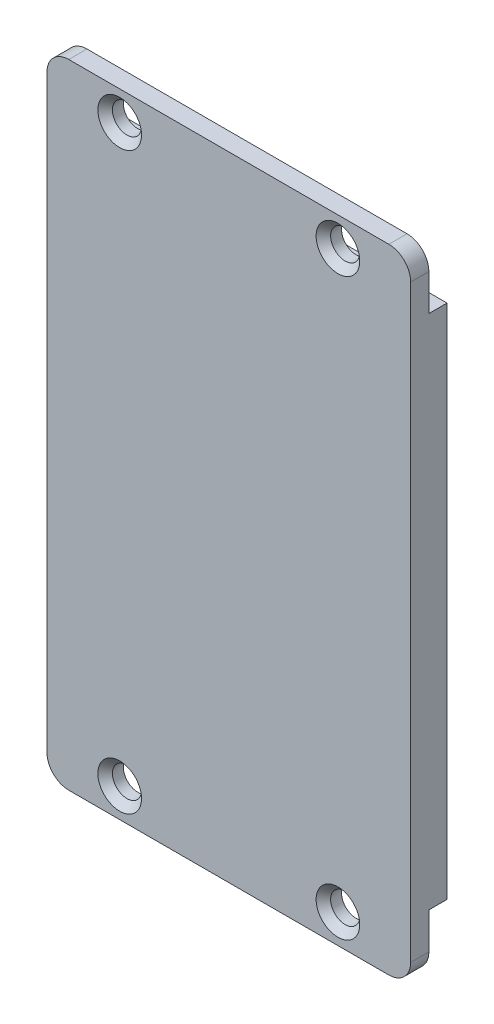
from build123d import *

# Parameters (mm, degrees)
ESQUISSE1_W             = 50
ESQUISSE1_H             = 71
BOSS_EXTRU_1_DEPTH      = 2.5
ESQUISSE2_W             = 50
ESQUISSE2_H             = 87
BOSS_EXTRU_2_DEPTH      = 2.5
CONG_1_R                = 3
ESQUISSE3_R             = 2
ENL_V_MAT_EXTRU_1_DEPTH = 2.5
CHANFREIN1_SIZE         = 1
ENL_V_MAT_EXTRU_2_DEPTH = 2


with BuildPart() as part:
    # Esquisse1 → Boss.-Extru.1 (new body)
    with BuildSketch(Plane.XY):
        with Locations((25, 35.5)):
            Rectangle(ESQUISSE1_W, ESQUISSE1_H)
    extrude(amount=BOSS_EXTRU_1_DEPTH)

    # Esquisse2 → Boss.-Extru.2 (add)
    with BuildSketch(Plane.XY.offset(2.5)):
        with Locations((25, 35.5)):
            Rectangle(ESQUISSE2_W, ESQUISSE2_H)
    extrude(amount=BOSS_EXTRU_2_DEPTH)

    # Congé1
    cong_1_edges = [part.edges().sort_by_distance(p)[0] for p in [
        (50, 79, 3.75),
        (0, 79, 3.75),
        (0, -8, 3.75),
        (50, -8, 3.75),
    ]]
    fillet(cong_1_edges, radius=CONG_1_R)

    # Esquisse3 → Enlèv. mat.-Extru.1 (cut)
    with BuildSketch(Plane(origin=(0, 0, 2.5), x_dir=(-1, 0, 0), z_dir=(0, 0, -1))):
        with Locations((-40, 75)):
            Circle(ESQUISSE3_R)
        with Locations((-10, 75)):
            Circle(ESQUISSE3_R)
        with Locations((-10, -4)):
            Circle(ESQUISSE3_R)
        with Locations((-40, -4)):
            Circle(ESQUISSE3_R)
    extrude(amount=-ENL_V_MAT_EXTRU_1_DEPTH, mode=Mode.SUBTRACT)

    # Chanfrein1
    chanfrein1_edges = [part.edges().sort_by_distance(p)[0] for p in [
        (42, 75, 5),
        (12, 75, 5),
        (12, -4, 5),
        (42, -4, 5),
    ]]
    chamfer(chanfrein1_edges, length=CHANFREIN1_SIZE)

    # Esquisse5 → Enlèv. mat.-Extru.2 (cut)
    # profile 1 of 18: a face of its own
    with BuildSketch(Plane(origin=(0, 0, 0), x_dir=(-1, 0, 0), z_dir=(0, 0, -1))):
        with BuildLine():
            Line((-39.669503138, 48.463046048), (-41.526907536, 48.68844165))
            add(Edge.make_bspline(
                [(-41.526907536, 48.68844165), (-41.525631119, 48.729845633), (-41.523148616, 48.810372261), (-41.534091281, 48.928410894), (-41.55109771, 49.040822239), (-41.579850915, 49.147342836), (-41.620503558, 49.246539166), (-41.668775989, 49.340756296), (-41.727795172, 49.428558817), (-41.796908269, 49.50946397), (-41.87367275, 49.582495521), (-41.956990264, 49.647597233), (-42.048377955, 49.69955497), (-42.14421988, 49.74612563), (-42.248191841, 49.778139065), (-42.357446943, 49.804680677), (-42.473527626, 49.818677229), (-42.5530086, 49.820509885), (-42.593619341, 49.82144628)],
                knots=[0, 0, 0, 0, 1.123362419, 2.184828125, 3.212186371, 4.20695908, 5.170945933, 6.117250307, 7.076103118, 8.035451973, 8.999685559, 9.948563037, 10.896876286, 11.848257403, 12.834625122, 13.842523067, 14.897638859, 16, 16, 16, 16], degree=3))
            add(Edge.make_bspline(
                [(-42.593619341, 49.82144628), (-42.633470503, 49.820394961), (-42.712051888, 49.818321896), (-42.826724533, 49.79877795), (-42.935055476, 49.765864736), (-43.036964477, 49.720867909), (-43.13376396, 49.664095163), (-43.22216347, 49.591854007), (-43.307066042, 49.509423755), (-43.3833227, 49.412147194), (-43.454937418, 49.303605975), (-43.518374845, 49.181474908), (-43.578049003, 49.047871753), (-43.628765378, 48.899774424), (-43.676180699, 48.740376162), (-43.715187577, 48.567419854), (-43.750877928, 48.382691982), (-43.767501173, 48.254234233), (-43.776042258, 48.18823216)],
                knots=[0, 0, 0, 0, 0.859944539, 1.695700435, 2.502545444, 3.298827662, 4.096290433, 4.917328608, 5.757754069, 6.646533457, 7.580121098, 8.561958734, 9.614563834, 10.736760485, 11.939151564, 13.203865151, 14.563335432, 16, 16, 16, 16], degree=3))
            add(Edge.make_bspline(
                [(-43.776042258, 48.18823216), (-43.785881648, 48.110793063), (-43.804850723, 47.961500477), (-43.808186058, 47.811054762), (-43.809791332, 47.73864628)],
                knots=[0, 0, 0, 0, 1.037413823, 2, 2, 2, 2], degree=3))
            add(Edge.make_bspline(
                [(-43.809791332, 47.73864628), (-43.808924986, 47.690022056), (-43.807255416, 47.596316322), (-43.799338691, 47.460260534), (-43.783933962, 47.333377988), (-43.760901955, 47.215989093), (-43.733338437, 47.107511497), (-43.700062772, 47.008369737), (-43.659427723, 46.918510535), (-43.625943795, 46.864472219), (-43.609707536, 46.838269197)],
                knots=[0, 0, 0, 0, 1.248524323, 2.406082419, 3.497449492, 4.527164035, 5.475378442, 6.369178394, 7.209219338, 8, 8, 8, 8], degree=3))
            add(Edge.make_bspline(
                [(-43.609707536, 46.838269197), (-43.588773506, 46.809498258), (-43.546742699, 46.751732706), (-43.469393665, 46.676344556), (-43.384047699, 46.607373322), (-43.285964974, 46.552210597), (-43.180733328, 46.500692093), (-43.062984863, 46.463870333), (-42.936187491, 46.433069315), (-42.84768375, 46.4204757), (-42.802140406, 46.413995122)],
                knots=[0, 0, 0, 0, 0.905132735, 1.817302228, 2.743101841, 3.693042224, 4.677712578, 5.723454696, 6.828507317, 8, 8, 8, 8], degree=3))
            add(Edge.make_bspline(
                [(-42.802140406, 46.413995122), (-42.775237293, 46.411687809), (-42.722694437, 46.407181534), (-42.669970876, 46.406090335), (-42.644242952, 46.405557854)],
                knots=[0, 0, 0, 0, 1.024044541, 2, 2, 2, 2], degree=3))
            add(Edge.make_bspline(
                [(-42.644242952, 46.405557854), (-42.584901661, 46.408202471), (-42.469837558, 46.413330443), (-42.305432746, 46.456935684), (-42.156426827, 46.527174196), (-42.025406844, 46.628596087), (-41.912100651, 46.758092696), (-41.815492268, 46.915151961), (-41.734343323, 47.099713977), (-41.697092069, 47.235031079), (-41.677573045, 47.305934937)],
                knots=[0, 0, 0, 0, 0.987255588, 1.914310893, 2.812497517, 3.714864786, 4.653758333, 5.664138951, 6.776048554, 8, 8, 8, 8], degree=3))
            Line((-41.677573045, 47.305934937), (-39.80329411, 47.073307391))
            add(Edge.make_bspline(
                [(-39.80329411, 47.073307391), (-39.826143911, 46.977618698), (-39.870933174, 46.790053569), (-39.965016525, 46.521859717), (-40.075634114, 46.271177724), (-40.204662039, 46.03882647), (-40.352458981, 45.824921192), (-40.519677913, 45.630224649), (-40.705099049, 45.452997279), (-40.908338191, 45.295556926), (-41.126394668, 45.159828958), (-41.355771842, 45.045299086), (-41.59607628, 44.954803543), (-41.847350967, 44.888484255), (-42.108862544, 44.845088432), (-42.380676506, 44.825316188), (-42.66344231, 44.826732417), (-42.854084348, 44.847366898), (-42.951600591, 44.857921743)],
                knots=[0, 0, 0, 0, 1.102838176, 2.161739052, 3.182557096, 4.173084825, 5.138138925, 6.093729667, 7.046766772, 8.010367777, 8.971943433, 9.923188913, 10.881549013, 11.846750406, 12.83357053, 13.850411987, 14.900453706, 16, 16, 16, 16], degree=3))
            add(Edge.make_bspline(
                [(-42.951600591, 44.857921743), (-43.070499541, 44.8747305), (-43.302539101, 44.907533958), (-43.636541234, 44.990404834), (-43.947675362, 45.097506144), (-44.236800821, 45.229130659), (-44.50304481, 45.386321203), (-44.747293766, 45.567953663), (-44.968068766, 45.775452494), (-45.164172836, 46.007273286), (-45.335623724, 46.259080909), (-45.478684648, 46.528990871), (-45.590873956, 46.816018904), (-45.675646619, 47.118777036), (-45.730751696, 47.438643238), (-45.756410625, 47.77507004), (-45.754650117, 48.127970566), (-45.730287699, 48.367152889), (-45.717819341, 48.489563178)],
                knots=[0, 0, 0, 0, 1.114665885, 2.17534791, 3.19021072, 4.167007121, 5.120540981, 6.056395418, 6.988253963, 7.928057672, 8.870908473, 9.812340497, 10.75887605, 11.727621057, 12.727570493, 13.768161322, 14.857775052, 16, 16, 16, 16], degree=3))
            add(Edge.make_bspline(
                [(-45.717819341, 48.489563178), (-45.701396863, 48.607655723), (-45.669248092, 48.838834596), (-45.587248083, 49.17213264), (-45.482789084, 49.485562146), (-45.352267701, 49.777525926), (-45.198916648, 50.050060271), (-45.019525067, 50.300171166), (-44.81628646, 50.531063988), (-44.662309605, 50.665976559), (-44.584814712, 50.733876604)],
                knots=[0, 0, 0, 0, 1.109291129, 2.171556822, 3.189905196, 4.181069691, 5.144152711, 6.095897557, 7.041685738, 8, 8, 8, 8], degree=3))
            add(Edge.make_bspline(
                [(-44.584814712, 50.733876604), (-44.50565913, 50.794282803), (-44.349419941, 50.91351401), (-44.095759645, 51.060729493), (-43.832928073, 51.181190177), (-43.558070979, 51.270282509), (-43.273470147, 51.33241522), (-42.978218847, 51.364211023), (-42.672119432, 51.368787649), (-42.466144218, 51.34823586), (-42.360991795, 51.337743965)],
                knots=[0, 0, 0, 0, 1.007196904, 1.988029443, 2.96189612, 3.929174451, 4.907287494, 5.90581505, 6.930897475, 8, 8, 8, 8], degree=3))
            add(Edge.make_bspline(
                [(-42.360991795, 51.337743965), (-42.252275903, 51.32185471), (-42.040435402, 51.290893388), (-41.734311721, 51.222449451), (-41.449310594, 51.1340934), (-41.183301167, 51.02976494), (-40.938553972, 50.905504136), (-40.713091175, 50.763898592), (-40.509128128, 50.603021313), (-40.324741471, 50.425474673), (-40.162862409, 50.230900945), (-40.023554921, 50.02090472), (-39.905998533, 49.796922205), (-39.811384576, 49.55827341), (-39.742044544, 49.304598422), (-39.694264699, 49.036778924), (-39.66651474, 48.75451798), (-39.668493299, 48.561540188), (-39.669503138, 48.463046048)],
                knots=[0, 0, 0, 0, 1.199145566, 2.336618803, 3.42010431, 4.453658018, 5.452069428, 6.412133963, 7.355380199, 8.282820828, 9.201550358, 10.112679088, 11.028861027, 11.958166568, 12.909485082, 13.89454139, 14.925392749, 16, 16, 16, 16], degree=3))
        make_face()
    # profile 2 of 18: a face of its own
    with BuildSketch(Plane(origin=(0, 0, 0), x_dir=(-1, 0, 0), z_dir=(0, 0, -1))):
        Polygon((-37.389029989, 51.05208216), (-38.130304295, 45.012203224), (-39.855123045, 45.220724289), (-39.113848739, 51.260603224), align=None)
    # profile 3 of 18: a face of its own
    with BuildSketch(Plane(origin=(0, 0, 0), x_dir=(-1, 0, 0), z_dir=(0, 0, -1))):
        with BuildLine():
            Line((-32.081988091, 45.489511558), (-33.682658462, 45.237598826))
            Line((-33.682658462, 45.237598826), (-33.783905684, 45.880036558))
            add(Edge.make_bspline(
                [(-33.783905684, 45.880036558), (-33.810586339, 45.82945869), (-33.862547842, 45.730956534), (-33.949412085, 45.592471692), (-34.043647907, 45.468423451), (-34.142607493, 45.357018339), (-34.246636217, 45.25787503), (-34.357945487, 45.173988128), (-34.474001921, 45.101166081), (-34.556438271, 45.064310094), (-34.597499434, 45.045952298)],
                knots=[0, 0, 0, 0, 1.152425571, 2.244388854, 3.290742021, 4.288812914, 5.245582002, 6.181805052, 7.09436553, 8, 8, 8, 8], degree=3))
            add(Edge.make_bspline(
                [(-34.597499434, 45.045952298), (-34.673339336, 45.01710837), (-34.823648209, 44.959941914), (-35.056409138, 44.901492122), (-35.291415207, 44.865133348), (-35.4491315, 44.860326017), (-35.528009619, 44.857921743)],
                knots=[0, 0, 0, 0, 1.018730202, 2.019045172, 3.009271728, 4, 4, 4, 4], degree=3))
            add(Edge.make_bspline(
                [(-35.528009619, 44.857921743), (-35.579504926, 44.858899701), (-35.680065707, 44.860809472), (-35.826876271, 44.880972382), (-35.965740156, 44.911944529), (-36.097068759, 44.954981148), (-36.219675532, 45.012902758), (-36.335553626, 45.080782814), (-36.442808835, 45.162911192), (-36.54214064, 45.257530759), (-36.633229836, 45.364979036), (-36.717381916, 45.484010463), (-36.791920064, 45.616457468), (-36.858707937, 45.76104942), (-36.919960292, 45.917666018), (-36.970679307, 46.087177431), (-37.014519545, 46.269082411), (-37.036568882, 46.394970739), (-37.047923276, 46.459797437)],
                knots=[0, 0, 0, 0, 1.01102019, 1.974334873, 2.904889327, 3.803395928, 4.682630308, 5.563810878, 6.436752615, 7.329974655, 8.253675836, 9.199633251, 10.189357243, 11.234520273, 12.326466074, 13.489918512, 14.707423506, 16, 16, 16, 16], degree=3))
            Line((-37.047923276, 46.459797437), (-37.463760082, 49.098251835))
            Line((-37.463760082, 49.098251835), (-35.755815869, 49.363423132))
            Line((-35.755815869, 49.363423132), (-35.380960082, 47.014246511))
            add(Edge.make_bspline(
                [(-35.380960082, 47.014246511), (-35.369788249, 46.952363562), (-35.348851653, 46.836391703), (-35.294087166, 46.67837156), (-35.225361287, 46.546728017), (-35.138161046, 46.443543902), (-35.035147496, 46.367932165), (-34.915385429, 46.322817375), (-34.780782494, 46.305863532), (-34.688243964, 46.316702768), (-34.639685776, 46.322390493)],
                knots=[0, 0, 0, 0, 1.302050775, 2.44011076, 3.45393118, 4.363760116, 5.216873127, 6.073881281, 6.989298455, 8, 8, 8, 8], degree=3))
            add(Edge.make_bspline(
                [(-34.639685776, 46.322390493), (-34.613406494, 46.327363411), (-34.562505114, 46.336995653), (-34.490275972, 46.361981521), (-34.42400041, 46.392818635), (-34.363713859, 46.431510355), (-34.311767873, 46.47991468), (-34.264354975, 46.533812526), (-34.223881629, 46.596231972), (-34.192571458, 46.666783721), (-34.163578584, 46.743185593), (-34.144041425, 46.828371043), (-34.129386367, 46.920568084), (-34.122739612, 47.020563425), (-34.121614437, 47.127596776), (-34.126787822, 47.242223846), (-34.137301866, 47.36458958), (-34.149849393, 47.448221457), (-34.156350823, 47.491554845)],
                knots=[0, 0, 0, 0, 0.898334421, 1.740019453, 2.561954172, 3.352647494, 4.136966489, 4.941505577, 5.762217922, 6.626585872, 7.532709611, 8.505948867, 9.558830195, 10.669669225, 11.872197238, 13.156850777, 14.526838208, 16, 16, 16, 16], degree=3))
            Line((-34.156350823, 47.491554845), (-34.480582999, 49.603282622))
            Line((-34.480582999, 49.603282622), (-32.772638786, 49.872069891))
            Line((-32.772638786, 49.872069891), (-32.081988091, 45.489511558))
        make_face()
    # profile 4 of 18: a face of its own
    with BuildSketch(Plane(origin=(0, 0, 0), x_dir=(-1, 0, 0), z_dir=(0, 0, -1))):
        with BuildLine():
            add(Edge.make_bspline(
                [(-27.302878138, 47.818197669), (-27.294723963, 47.744353761), (-27.278229087, 47.594976768), (-27.277860382, 47.365177936), (-27.290954963, 47.128192294), (-27.314847056, 46.968708025), (-27.326984619, 46.887687484)],
                knots=[0, 0, 0, 0, 0.953776437, 1.9293705, 2.948087341, 4, 4, 4, 4], degree=3))
            add(Edge.make_bspline(
                [(-27.326984619, 46.887687484), (-27.337788481, 46.828937314), (-27.35902919, 46.713432759), (-27.397977644, 46.544651346), (-27.440603577, 46.383055157), (-27.49041482, 46.230038728), (-27.544352211, 46.084516419), (-27.6050589, 45.947262785), (-27.669412411, 45.816642394), (-27.741212848, 45.6948192), (-27.816710693, 45.580138059), (-27.897956679, 45.473342914), (-27.984464504, 45.374561805), (-28.076714051, 45.284010606), (-28.172949728, 45.199971049), (-28.276129418, 45.125814514), (-28.383225867, 45.057032282), (-28.459209237, 45.019161711), (-28.497354295, 45.000149984)],
                knots=[0, 0, 0, 0, 1.240555807, 2.438969104, 3.596834556, 4.710493293, 5.779973763, 6.818769056, 7.826394049, 8.802495508, 9.753738785, 10.676706813, 11.58733184, 12.478360436, 13.359960724, 14.237919982, 15.115403209, 16, 16, 16, 16], degree=3))
            add(Edge.make_bspline(
                [(-28.497354295, 45.000149984), (-28.550279836, 44.977731943), (-28.657497847, 44.932316862), (-28.83054015, 44.891717741), (-29.012173082, 44.861560998), (-29.137241012, 44.859153927), (-29.201263554, 44.857921743)],
                knots=[0, 0, 0, 0, 0.951704315, 1.927988688, 2.939332959, 4, 4, 4, 4], degree=3))
            add(Edge.make_bspline(
                [(-29.201263554, 44.857921743), (-29.271730181, 44.859952898), (-29.417379921, 44.864151158), (-29.561029548, 44.888661425), (-29.635180221, 44.90131341)],
                knots=[0, 0, 0, 0, 0.967617617, 2, 2, 2, 2], degree=3))
            add(Edge.make_bspline(
                [(-29.635180221, 44.90131341), (-29.709187133, 44.917194234), (-29.852364339, 44.947918015), (-30.053599149, 45.022275553), (-30.233054133, 45.11781464), (-30.392658068, 45.232968457), (-30.528842073, 45.371355735), (-30.644346042, 45.529569276), (-30.738499301, 45.708836961), (-30.782026147, 45.838740313), (-30.804344573, 45.905348363)],
                knots=[0, 0, 0, 0, 1.112386028, 2.152073608, 3.143593023, 4.095205172, 5.035518096, 5.987130246, 6.967899389, 8, 8, 8, 8], degree=3))
            Line((-30.804344573, 45.905348363), (-30.82121911, 45.893295122))
            Line((-30.82121911, 45.893295122), (-30.9309036, 45.278579845))
            Line((-30.9309036, 45.278579845), (-32.526752675, 45.544956465))
            Line((-32.526752675, 45.544956465), (-31.476915406, 51.492025447))
            Line((-31.476915406, 51.492025447), (-29.768971193, 51.195515724))
            Line((-29.768971193, 51.195515724), (-30.135389712, 49.163339335))
            add(Edge.make_bspline(
                [(-30.135389712, 49.163339335), (-30.087197922, 49.201078793), (-29.992738615, 49.275050789), (-29.838386302, 49.364717226), (-29.678757197, 49.436070373), (-29.513296235, 49.489997978), (-29.341092488, 49.522108483), (-29.163800693, 49.536588236), (-28.979820669, 49.532129215), (-28.85680612, 49.513816171), (-28.793864017, 49.504446048)],
                knots=[0, 0, 0, 0, 1.025632263, 2.010311549, 2.984629283, 3.954275124, 4.921693912, 5.915576545, 6.933475791, 8, 8, 8, 8], degree=3))
            add(Edge.make_bspline(
                [(-28.793864017, 49.504446048), (-28.742612945, 49.49368876), (-28.641840299, 49.472537195), (-28.496078221, 49.425725448), (-28.357056596, 49.368938382), (-28.223970125, 49.302134639), (-28.09985774, 49.221527887), (-27.981716108, 49.131836606), (-27.870504741, 49.030782674), (-27.803247071, 48.95543858), (-27.769338554, 48.917453224)],
                knots=[0, 0, 0, 0, 1.042784053, 2.050378759, 3.044851098, 4.032923894, 5.012169926, 5.988795021, 6.986034168, 8, 8, 8, 8], degree=3))
            add(Edge.make_bspline(
                [(-27.769338554, 48.917453224), (-27.739054833, 48.879702375), (-27.678499925, 48.804216298), (-27.597400828, 48.683163824), (-27.526608289, 48.554924509), (-27.463536176, 48.420533966), (-27.409234787, 48.279648633), (-27.3648655, 48.131642896), (-27.328393373, 47.977491665), (-27.311457488, 47.871759355), (-27.302878138, 47.818197669)],
                knots=[0, 0, 0, 0, 0.959555228, 1.918713345, 2.885388696, 3.862127047, 4.861009477, 5.876878617, 6.924472922, 8, 8, 8, 8], degree=3))
        make_face()
        with BuildLine():
            add(Edge.make_bspline(
                [(-29.019259619, 47.446957854), (-29.02044407, 47.504150722), (-29.022695584, 47.612868188), (-29.051139868, 47.766089759), (-29.094782749, 47.90095189), (-29.157677985, 48.01669184), (-29.240419448, 48.112086159), (-29.341734912, 48.186796994), (-29.461086542, 48.242301395), (-29.548678944, 48.261448895), (-29.594199202, 48.271399521)],
                knots=[0, 0, 0, 0, 1.235439113, 2.348436323, 3.356931058, 4.290419323, 5.177367275, 6.065463821, 6.994654944, 8, 8, 8, 8], degree=3))
            add(Edge.make_bspline(
                [(-29.594199202, 48.271399521), (-29.615875429, 48.273704335), (-29.657552731, 48.278135848), (-29.699447478, 48.279285207), (-29.719552906, 48.279836789)],
                knots=[0, 0, 0, 0, 1.040193386, 2, 2, 2, 2], degree=3))
            add(Edge.make_bspline(
                [(-29.719552906, 48.279836789), (-29.750593296, 48.278798922), (-29.812089896, 48.27674272), (-29.901437883, 48.256745958), (-29.985812353, 48.225061244), (-30.065319113, 48.181213279), (-30.139030486, 48.123663081), (-30.207943688, 48.054226441), (-30.272703508, 47.97281014), (-30.309269884, 47.911485941), (-30.328241563, 47.879669197)],
                knots=[0, 0, 0, 0, 0.970485494, 1.922706426, 2.850100465, 3.784631022, 4.753158575, 5.767010399, 6.841461271, 8, 8, 8, 8], degree=3))
            add(Edge.make_bspline(
                [(-30.328241563, 47.879669197), (-30.35628724, 47.822856935), (-30.412717436, 47.708546015), (-30.47022696, 47.523098041), (-30.504337794, 47.326087841), (-30.509043066, 47.190766351), (-30.511450823, 47.121520354)],
                knots=[0, 0, 0, 0, 0.96388673, 1.939418969, 2.94557038, 4, 4, 4, 4], degree=3))
            add(Edge.make_bspline(
                [(-30.511450823, 47.121520354), (-30.510122674, 47.06114227), (-30.507602195, 46.946560478), (-30.481116555, 46.784747134), (-30.43762264, 46.64298984), (-30.37420202, 46.522341401), (-30.293465761, 46.422195353), (-30.194260575, 46.342889116), (-30.076540905, 46.285028563), (-29.989713878, 46.265939439), (-29.944948508, 46.256097669)],
                knots=[0, 0, 0, 0, 1.270886158, 2.411809118, 3.442290992, 4.381228634, 5.265518528, 6.13259004, 7.037220299, 8, 8, 8, 8], degree=3))
            add(Edge.make_bspline(
                [(-29.944948508, 46.256097669), (-29.92050942, 46.251487736), (-29.873479196, 46.242616449), (-29.825680528, 46.240324215), (-29.802720267, 46.239223132)],
                knots=[0, 0, 0, 0, 1.039292861, 2, 2, 2, 2], degree=3))
            add(Edge.make_bspline(
                [(-29.802720267, 46.239223132), (-29.771698642, 46.240809792), (-29.710267296, 46.243951815), (-29.620412784, 46.263037087), (-29.535639439, 46.297466504), (-29.457267007, 46.34677257), (-29.382359821, 46.407597813), (-29.314034313, 46.48343388), (-29.249601025, 46.571841556), (-29.213012532, 46.637745598), (-29.19403161, 46.671934474)],
                knots=[0, 0, 0, 0, 0.944345374, 1.870063407, 2.780555981, 3.713753548, 4.678150288, 5.707921183, 6.810943948, 8, 8, 8, 8], degree=3))
            add(Edge.make_bspline(
                [(-29.19403161, 46.671934474), (-29.167269683, 46.731241845), (-29.11344331, 46.850527001), (-29.058599818, 47.041342087), (-29.025291362, 47.241271317), (-29.021290008, 47.377720216), (-29.019259619, 47.446957854)],
                knots=[0, 0, 0, 0, 0.973352051, 1.957706959, 2.963688629, 4, 4, 4, 4], degree=3))
        make_face(mode=Mode.SUBTRACT)
    # profile 5 of 18: a face of its own
    with BuildSketch(Plane(origin=(0, 0, 0), x_dir=(-1, 0, 0), z_dir=(0, 0, -1))):
        with BuildLine():
            add(Edge.make_bspline(
                [(-39.735795962, 37.910852761), (-39.742435761, 37.862942058), (-39.755448723, 37.769044618), (-39.784549319, 37.632975262), (-39.820335461, 37.504761424), (-39.864321943, 37.385074179), (-39.913078843, 37.272537888), (-39.970218979, 37.168221798), (-40.034005337, 37.071926417), (-40.104013504, 36.983067997), (-40.181903432, 36.903092586), (-40.266686055, 36.830607748), (-40.357761426, 36.76515466), (-40.457171406, 36.710062623), (-40.561472257, 36.659579929), (-40.674700721, 36.620711347), (-40.793834321, 36.58776409), (-40.876298613, 36.572344324), (-40.918218878, 36.564505771)],
                knots=[0, 0, 0, 0, 1.192870653, 2.33783877, 3.429711171, 4.473798674, 5.48115766, 6.452523416, 7.403654426, 8.32775437, 9.238954659, 10.152738696, 11.076785488, 12.000034609, 12.953280564, 13.931348428, 14.948412446, 16, 16, 16, 16], degree=3))
            add(Edge.make_bspline(
                [(-40.918218878, 36.564505771), (-40.880252055, 36.544368615), (-40.806788935, 36.505404642), (-40.703870204, 36.443360392), (-40.608879327, 36.384898375), (-40.524744666, 36.32566767), (-40.449685651, 36.268024244), (-40.384438644, 36.211338074), (-40.328234993, 36.156248337), (-40.296762522, 36.117610294), (-40.281807767, 36.099250678)],
                knots=[0, 0, 0, 0, 1.299362644, 2.514174893, 3.633355664, 4.67151853, 5.624185802, 6.493989502, 7.284389892, 8, 8, 8, 8], degree=3))
            add(Edge.make_bspline(
                [(-40.281807767, 36.099250678), (-40.265969968, 36.07710614), (-40.233488406, 36.031690161), (-40.194807203, 35.955361058), (-40.160428364, 35.872520074), (-40.132920451, 35.782515634), (-40.113052524, 35.684724909), (-40.096869588, 35.580626422), (-40.089139507, 35.468577191), (-40.087430205, 35.391733274), (-40.086545267, 35.351949752)],
                knots=[0, 0, 0, 0, 0.83057356, 1.703413832, 2.605948108, 3.568721566, 4.572472497, 5.652064666, 6.784430298, 8, 8, 8, 8], degree=3))
            add(Edge.make_bspline(
                [(-40.086545267, 35.351949752), (-40.088059231, 35.272751387), (-40.091245195, 35.106087475), (-40.106343894, 34.940071234), (-40.114267721, 34.852945585)],
                knots=[0, 0, 0, 0, 0.95039609, 2, 2, 2, 2], degree=3))
            Line((-40.114267721, 34.852945585), (-40.156454063, 34.487732391))
            add(Edge.make_bspline(
                [(-40.156454063, 34.487732391), (-40.162987183, 34.425489134), (-40.174900785, 34.311984179), (-40.184177508, 34.158077779), (-40.188589063, 34.037046987), (-40.180387203, 33.968205363), (-40.176944573, 33.939309937)],
                knots=[0, 0, 0, 0, 1.365048024, 2.489261036, 3.365885876, 4, 4, 4, 4], degree=3))
            add(Edge.make_bspline(
                [(-40.176944573, 33.939309937), (-40.173059893, 33.917998682), (-40.16575658, 33.877932894), (-40.134615504, 33.826323414), (-40.085926708, 33.792290773), (-40.04769244, 33.785173954), (-40.027484388, 33.781412484)],
                knots=[0, 0, 0, 0, 1.090063701, 2.049351834, 2.969019084, 4, 4, 4, 4], degree=3))
            Line((-40.027484388, 33.781412484), (-40.052796193, 33.598203224))
            Line((-40.052796193, 33.598203224), (-42.025911702, 33.838062715))
            add(Edge.make_bspline(
                [(-42.025911702, 33.838062715), (-42.029800756, 33.861731325), (-42.03859823, 33.915272358), (-42.046276524, 34.005464323), (-42.050976715, 34.114430396), (-42.051136909, 34.193224798), (-42.051223508, 34.23581966)],
                knots=[0, 0, 0, 0, 0.721016373, 1.631019397, 2.719370918, 4, 4, 4, 4], degree=3))
            add(Edge.make_bspline(
                [(-42.051223508, 34.23581966), (-42.04830335, 34.28485643), (-42.042215194, 34.387091808), (-42.026710594, 34.546429802), (-42.001693356, 34.71784663), (-41.981935797, 34.836108022), (-41.971672119, 34.897542576)],
                knots=[0, 0, 0, 0, 0.883825219, 1.842662245, 2.879303867, 4, 4, 4, 4], degree=3))
            add(Edge.make_bspline(
                [(-41.971672119, 34.897542576), (-41.961838879, 34.962908661), (-41.943260115, 35.086410275), (-41.939631249, 35.211231167), (-41.937923045, 35.269987715)],
                knots=[0, 0, 0, 0, 1.058546245, 2, 2, 2, 2], degree=3))
            add(Edge.make_bspline(
                [(-41.937923045, 35.269987715), (-41.938905264, 35.305781523), (-41.940799635, 35.374815745), (-41.95361006, 35.473967353), (-41.976755862, 35.564600616), (-42.008625755, 35.646337337), (-42.050675457, 35.719339991), (-42.101206542, 35.78329571), (-42.161186502, 35.83910683), (-42.207381222, 35.867757331), (-42.230816795, 35.882292345)],
                knots=[0, 0, 0, 0, 1.203628154, 2.3213941, 3.353582548, 4.342050901, 5.26204003, 6.175658242, 7.074472292, 8, 8, 8, 8], degree=3))
            add(Edge.make_bspline(
                [(-42.230816795, 35.882292345), (-42.271324081, 35.902737926), (-42.360127631, 35.947560484), (-42.516497304, 35.993492566), (-42.701729065, 36.036889408), (-42.836855651, 36.05472119), (-42.909414249, 36.06429628)],
                knots=[0, 0, 0, 0, 0.769352769, 1.686641169, 2.757801268, 4, 4, 4, 4], degree=3))
            Line((-42.909414249, 36.06429628), (-43.509665638, 36.139026372))
            Line((-43.509665638, 36.139026372), (-43.767604989, 34.04055716))
            Line((-43.767604989, 34.04055716), (-45.717819341, 34.27439003))
            Line((-45.717819341, 34.27439003), (-44.976545036, 40.309447669))
            Line((-44.976545036, 40.309447669), (-42.168139943, 39.946645122))
            add(Edge.make_bspline(
                [(-42.168139943, 39.946645122), (-42.090524565, 39.936698973), (-41.939000624, 39.91728169), (-41.718503015, 39.880504398), (-41.509283968, 39.841360099), (-41.312096647, 39.79635331), (-41.12615686, 39.749418386), (-40.953300818, 39.694262744), (-40.791693742, 39.636412053), (-40.640572815, 39.576388026), (-40.503610302, 39.507725162), (-40.376490879, 39.438456376), (-40.262538779, 39.362336704), (-40.159139577, 39.282935709), (-40.068120659, 39.198340324), (-39.989705357, 39.10889126), (-39.921998188, 39.015533682), (-39.886159954, 38.949065864), (-39.86838161, 38.916093039)],
                knots=[0, 0, 0, 0, 1.437651169, 2.806641879, 4.106804341, 5.347928479, 6.522523811, 7.629226374, 8.680003107, 9.676638739, 10.614275949, 11.493356846, 12.334872421, 13.129317278, 13.886676258, 14.613784353, 15.312337208, 16, 16, 16, 16], degree=3))
            add(Edge.make_bspline(
                [(-39.86838161, 38.916093039), (-39.845301962, 38.864780312), (-39.79823756, 38.760142541), (-39.75257832, 38.589956536), (-39.724326339, 38.408001297), (-39.720755294, 38.282605815), (-39.718921425, 38.2182104)],
                knots=[0, 0, 0, 0, 0.936789994, 1.910317807, 2.926867621, 4, 4, 4, 4], degree=3))
            add(Edge.make_bspline(
                [(-39.718921425, 38.2182104), (-39.719449408, 38.16915758), (-39.720554771, 38.066462775), (-39.730566433, 37.964245376), (-39.735795962, 37.910852761)],
                knots=[0, 0, 0, 0, 0.955312584, 2, 2, 2, 2], degree=3))
        make_face()
        with BuildLine():
            add(Edge.make_bspline(
                [(-41.576325823, 37.822864104), (-41.572817903, 37.873888383), (-41.566182501, 37.970403292), (-41.586013629, 38.109440742), (-41.635238846, 38.231147363), (-41.712533444, 38.335832671), (-41.817960286, 38.420891502), (-41.949519417, 38.487289808), (-42.106697377, 38.536616021), (-42.221624924, 38.553018736), (-42.28264573, 38.561727761)],
                knots=[0, 0, 0, 0, 1.049335773, 1.984869721, 2.859011755, 3.721213114, 4.63057412, 5.616786487, 6.734632272, 8, 8, 8, 8], degree=3))
            Line((-42.28264573, 38.561727761), (-43.198692026, 38.679849521))
            Line((-43.198692026, 38.679849521), (-43.336098971, 37.516711789))
            Line((-43.336098971, 37.516711789), (-42.568307536, 37.421491187))
            add(Edge.make_bspline(
                [(-42.568307536, 37.421491187), (-42.519536592, 37.406800265), (-42.42733267, 37.379026338), (-42.292395158, 37.355231601), (-42.169646237, 37.344070582), (-42.092581107, 37.352437135), (-42.056044804, 37.356403687)],
                knots=[0, 0, 0, 0, 1.172819176, 2.217273621, 3.154815786, 4, 4, 4, 4], degree=3))
            add(Edge.make_bspline(
                [(-42.056044804, 37.356403687), (-42.022068255, 37.362284314), (-41.956622333, 37.373611627), (-41.866089265, 37.405120702), (-41.786420087, 37.446366213), (-41.719341177, 37.50005836), (-41.664043211, 37.565105973), (-41.62159203, 37.641318263), (-41.590936106, 37.728170606), (-41.581321142, 37.790487986), (-41.576325823, 37.822864104)],
                knots=[0, 0, 0, 0, 1.132555457, 2.181538135, 3.139230303, 4.070012762, 4.988804116, 5.929663504, 6.924385822, 8, 8, 8, 8], degree=3))
        make_face(mode=Mode.SUBTRACT)
    # profile 6 of 18: a face of its own
    with BuildSketch(Plane(origin=(0, 0, 0), x_dir=(-1, 0, 0), z_dir=(0, 0, -1))):
        with BuildLine():
            add(Edge.make_bspline(
                [(-34.845796193, 36.498212947), (-34.834481335, 36.40433307), (-34.812486153, 36.221838083), (-34.80804289, 35.952645422), (-34.826602481, 35.697501981), (-34.869549719, 35.455567694), (-34.938689463, 35.22749254), (-35.031990322, 35.013147369), (-35.148530577, 34.811382692), (-35.246277617, 34.691427139), (-35.295382073, 34.631165956)],
                knots=[0, 0, 0, 0, 1.14383072, 2.223515631, 3.252481735, 4.235857041, 5.191130786, 6.129736819, 7.060449739, 8, 8, 8, 8], degree=3))
            add(Edge.make_bspline(
                [(-35.295382073, 34.631165956), (-35.359168188, 34.560726803), (-35.485873918, 34.420805376), (-35.705759394, 34.242079791), (-35.945299848, 34.090141816), (-36.2059675, 33.965028539), (-36.488951109, 33.870587669), (-36.792185128, 33.802366197), (-37.116175733, 33.758910402), (-37.339468874, 33.754664659), (-37.454117489, 33.752484706)],
                knots=[0, 0, 0, 0, 0.945478301, 1.878112776, 2.811862915, 3.765975592, 4.75062334, 5.776842528, 6.858532223, 8, 8, 8, 8], degree=3))
            add(Edge.make_bspline(
                [(-37.454117489, 33.752484706), (-37.547854555, 33.754672282), (-37.730835671, 33.758942581), (-37.997336802, 33.795919065), (-38.248016007, 33.855508042), (-38.482670967, 33.940266772), (-38.700813155, 34.049563347), (-38.903925853, 34.181389478), (-39.090308188, 34.339065519), (-39.19882052, 34.461037842), (-39.253666332, 34.522686789)],
                knots=[0, 0, 0, 0, 1.11045932, 2.167691993, 3.181675694, 4.159229687, 5.117470421, 6.067035888, 7.023014396, 8, 8, 8, 8], degree=3))
            add(Edge.make_bspline(
                [(-39.253666332, 34.522686789), (-39.285243608, 34.561983409), (-39.348803078, 34.641080552), (-39.433052133, 34.769358023), (-39.507734444, 34.90629324), (-39.574346588, 35.051077488), (-39.630745874, 35.204321958), (-39.677748166, 35.365905669), (-39.716521764, 35.535759914), (-39.734881622, 35.652751761), (-39.74423323, 35.71234165)],
                knots=[0, 0, 0, 0, 0.927278298, 1.866447142, 2.81939638, 3.795356626, 4.796558649, 5.821288569, 6.890271622, 8, 8, 8, 8], degree=3))
            add(Edge.make_bspline(
                [(-39.74423323, 35.71234165), (-39.754075405, 35.788976793), (-39.773349072, 35.939049326), (-39.776459989, 36.090316295), (-39.777982304, 36.164338178)],
                knots=[0, 0, 0, 0, 1.021308045, 2, 2, 2, 2], degree=3))
            add(Edge.make_bspline(
                [(-39.777982304, 36.164338178), (-39.775289361, 36.260529505), (-39.770045077, 36.447854125), (-39.726874737, 36.719577748), (-39.657726451, 36.973782346), (-39.558062834, 37.209525732), (-39.430172909, 37.427346312), (-39.274994263, 37.627745764), (-39.090312311, 37.809374329), (-38.949327739, 37.911787021), (-38.877605221, 37.963887021)],
                knots=[0, 0, 0, 0, 1.098248124, 2.138747015, 3.134181252, 4.10079197, 5.053200125, 6.011593718, 6.988446021, 8, 8, 8, 8], degree=3))
            add(Edge.make_bspline(
                [(-38.877605221, 37.963887021), (-38.833741207, 37.992941704), (-38.745619578, 38.051311785), (-38.606486046, 38.129792954), (-38.460298288, 38.199788042), (-38.307202791, 38.261103243), (-38.147258477, 38.31405647), (-37.980828978, 38.360024065), (-37.807381021, 38.397550543), (-37.688866396, 38.415325441), (-37.62888948, 38.424320817)],
                knots=[0, 0, 0, 0, 0.939734612, 1.887901666, 2.851028999, 3.833355893, 4.832066866, 5.859460637, 6.916733267, 8, 8, 8, 8], degree=3))
            add(Edge.make_bspline(
                [(-37.62888948, 38.424320817), (-37.546219798, 38.434163881), (-37.382855223, 38.45361488), (-37.218367123, 38.456596903), (-37.137117258, 38.458069891)],
                knots=[0, 0, 0, 0, 1.012088235, 2, 2, 2, 2], degree=3))
            add(Edge.make_bspline(
                [(-37.137117258, 38.458069891), (-37.069173654, 38.457023451), (-36.935412494, 38.454963315), (-36.738779043, 38.435409983), (-36.550030788, 38.402505574), (-36.36910769, 38.358853281), (-36.196963462, 38.300030498), (-36.032521056, 38.230487495), (-35.87575271, 38.147258173), (-35.778164844, 38.081291719), (-35.729298739, 38.048259706)],
                knots=[0, 0, 0, 0, 1.093941193, 2.153651472, 3.178007992, 4.177626742, 5.147465396, 6.104091792, 7.050643757, 8, 8, 8, 8], degree=3))
            add(Edge.make_bspline(
                [(-35.729298739, 38.048259706), (-35.669457317, 38.003867401), (-35.550677725, 37.915752853), (-35.394007768, 37.759120106), (-35.254361748, 37.588491249), (-35.133276461, 37.401879624), (-35.031268153, 37.19902708), (-34.950192976, 36.979610246), (-34.885008841, 36.745066358), (-34.859059907, 36.581711337), (-34.845796193, 36.498212947)],
                knots=[0, 0, 0, 0, 0.971774381, 1.928880705, 2.883424337, 3.846721878, 4.827419114, 5.841776794, 6.896831184, 8, 8, 8, 8], degree=3))
        make_face()
        with BuildLine():
            add(Edge.make_bspline(
                [(-36.562177675, 36.255942808), (-36.573084132, 36.324188538), (-36.594113798, 36.455778917), (-36.649615172, 36.64087144), (-36.717678892, 36.809385214), (-36.780823553, 36.908031635), (-36.811679758, 36.956236095)],
                knots=[0, 0, 0, 0, 1.104516121, 2.129711181, 3.086066579, 4, 4, 4, 4], degree=3))
            add(Edge.make_bspline(
                [(-36.811679758, 36.956236095), (-36.832000954, 36.983613419), (-36.871300853, 37.036559419), (-36.938247965, 37.10657458), (-37.0103603, 37.162919146), (-37.086703222, 37.207958855), (-37.167867308, 37.238951212), (-37.253386402, 37.258885643), (-37.34372216, 37.264752956), (-37.404732931, 37.259207281), (-37.436037628, 37.256361789)],
                knots=[0, 0, 0, 0, 1.116064923, 2.158398398, 3.161361871, 4.104805569, 5.050540852, 5.995451804, 6.971464014, 8, 8, 8, 8], degree=3))
            add(Edge.make_bspline(
                [(-37.436037628, 37.256361789), (-37.46839356, 37.250835794), (-37.531351622, 37.24008333), (-37.620526758, 37.209140907), (-37.701627146, 37.168174519), (-37.775257002, 37.116800428), (-37.840901118, 37.054538765), (-37.8986511, 36.981839465), (-37.949103391, 36.899014534), (-37.974039315, 36.838113889), (-37.98687073, 36.80677591)],
                knots=[0, 0, 0, 0, 1.049637383, 2.042380874, 3.009020527, 3.951294114, 4.906911682, 5.895477997, 6.917064575, 8, 8, 8, 8], degree=3))
            add(Edge.make_bspline(
                [(-37.98687073, 36.80677591), (-38.004182279, 36.751712932), (-38.039897663, 36.638112737), (-38.062766463, 36.454350877), (-38.066930783, 36.2558902), (-38.052336377, 36.119661837), (-38.044726286, 36.048627067)],
                knots=[0, 0, 0, 0, 0.901181054, 1.859222824, 2.883715469, 4, 4, 4, 4], degree=3))
            add(Edge.make_bspline(
                [(-38.044726286, 36.048627067), (-38.037573399, 36.000733396), (-38.023750102, 35.908176571), (-37.995835728, 35.775028147), (-37.963448096, 35.652377135), (-37.927222268, 35.539169009), (-37.886910011, 35.435722879), (-37.841067347, 35.342720224), (-37.791154, 35.259589004), (-37.737470554, 35.185852597), (-37.67824717, 35.12225393), (-37.613258459, 35.070571587), (-37.545897098, 35.025866774), (-37.472380418, 34.993532213), (-37.394741349, 34.969998881), (-37.312291157, 34.958682561), (-37.225733654, 34.955876742), (-37.167217669, 34.961927986), (-37.137117258, 34.965040724)],
                knots=[0, 0, 0, 0, 1.45683694, 2.815407536, 4.090976176, 5.27232098, 6.390294649, 7.428348409, 8.388279978, 9.304670397, 10.168435396, 10.993518077, 11.798335936, 12.593746806, 13.400831379, 14.231738868, 15.090412871, 16, 16, 16, 16], degree=3))
            add(Edge.make_bspline(
                [(-37.137117258, 34.965040724), (-37.089156807, 34.974370003), (-36.996423316, 34.992408544), (-36.869562963, 35.050416822), (-36.76221034, 35.13158434), (-36.675020529, 35.235566706), (-36.607663809, 35.36194354), (-36.562407818, 35.510940764), (-36.533027424, 35.681062134), (-36.530015578, 35.801799751), (-36.5284286, 35.865417808)],
                knots=[0, 0, 0, 0, 0.972262482, 1.879909219, 2.755368418, 3.637118599, 4.566146065, 5.592967283, 6.731706432, 8, 8, 8, 8], degree=3))
            add(Edge.make_bspline(
                [(-36.5284286, 35.865417808), (-36.530108714, 35.927386637), (-36.533655668, 36.058211473), (-36.552342422, 36.18775905), (-36.562177675, 36.255942808)],
                knots=[0, 0, 0, 0, 0.947355728, 2, 2, 2, 2], degree=3))
        make_face(mode=Mode.SUBTRACT)
    # profile 7 of 18: a face of its own
    with BuildSketch(Plane(origin=(0, 0, 0), x_dir=(-1, 0, 0), z_dir=(0, 0, -1))):
        with BuildLine():
            add(Edge.make_bspline(
                [(-30.002804063, 36.635619891), (-29.994649889, 36.561775983), (-29.978155012, 36.41239899), (-29.977786307, 36.182600158), (-29.990880889, 35.945614517), (-30.014772982, 35.786130247), (-30.026910545, 35.705109706)],
                knots=[0, 0, 0, 0, 0.953776437, 1.9293705, 2.948087341, 4, 4, 4, 4], degree=3))
            add(Edge.make_bspline(
                [(-30.026910545, 35.705109706), (-30.037714407, 35.646359537), (-30.058955116, 35.530854981), (-30.09790357, 35.362073568), (-30.140529503, 35.200477379), (-30.190340746, 35.04746095), (-30.244278137, 34.901938641), (-30.304984825, 34.764685007), (-30.369338337, 34.634064617), (-30.441138774, 34.512241422), (-30.516636619, 34.397560281), (-30.597882605, 34.290765136), (-30.68439043, 34.191984027), (-30.776639977, 34.101432828), (-30.872875654, 34.017393271), (-30.976055344, 33.943236736), (-31.083151793, 33.874454504), (-31.159135163, 33.836583933), (-31.197280221, 33.817572206)],
                knots=[0, 0, 0, 0, 1.240555807, 2.438969104, 3.596834556, 4.710493293, 5.779973763, 6.818769056, 7.826394049, 8.802495508, 9.753738785, 10.676706813, 11.58733184, 12.478360436, 13.359960724, 14.237919982, 15.115403209, 16, 16, 16, 16], degree=3))
            add(Edge.make_bspline(
                [(-31.197280221, 33.817572206), (-31.250205762, 33.795154165), (-31.357423773, 33.749739084), (-31.530466076, 33.709139963), (-31.712099008, 33.67898322), (-31.837166938, 33.67657615), (-31.90118948, 33.675343965)],
                knots=[0, 0, 0, 0, 0.951704315, 1.927988688, 2.939332959, 4, 4, 4, 4], degree=3))
            add(Edge.make_bspline(
                [(-31.90118948, 33.675343965), (-31.971656107, 33.67737512), (-32.117305847, 33.68157338), (-32.260955474, 33.706083648), (-32.335106147, 33.718735632)],
                knots=[0, 0, 0, 0, 0.967617617, 2, 2, 2, 2], degree=3))
            add(Edge.make_bspline(
                [(-32.335106147, 33.718735632), (-32.409113059, 33.734616457), (-32.552290265, 33.765340237), (-32.753525075, 33.839697775), (-32.932980059, 33.935236862), (-33.092583994, 34.050390679), (-33.228767999, 34.188777957), (-33.344271968, 34.346991498), (-33.438425227, 34.526259183), (-33.481952073, 34.656162535), (-33.504270499, 34.722770585)],
                knots=[0, 0, 0, 0, 1.112386028, 2.152073608, 3.143593023, 4.095205172, 5.035518096, 5.987130246, 6.967899389, 8, 8, 8, 8], degree=3))
            Line((-33.504270499, 34.722770585), (-33.521145036, 34.710717345))
            Line((-33.521145036, 34.710717345), (-33.630829526, 34.096002067))
            Line((-33.630829526, 34.096002067), (-35.2266786, 34.362378687))
            Line((-35.2266786, 34.362378687), (-34.176841332, 40.309447669))
            Line((-34.176841332, 40.309447669), (-32.468897119, 40.012937947))
            Line((-32.468897119, 40.012937947), (-32.835315638, 37.980761558))
            add(Edge.make_bspline(
                [(-32.835315638, 37.980761558), (-32.787123848, 38.018501015), (-32.692664541, 38.092473012), (-32.538312228, 38.182139449), (-32.378683123, 38.253492595), (-32.213222161, 38.3074202), (-32.041018414, 38.339530705), (-31.863726619, 38.354010458), (-31.679746595, 38.349551437), (-31.556732046, 38.331238394), (-31.493789943, 38.321868271)],
                knots=[0, 0, 0, 0, 1.025632263, 2.010311549, 2.984629283, 3.954275124, 4.921693912, 5.915576545, 6.933475791, 8, 8, 8, 8], degree=3))
            add(Edge.make_bspline(
                [(-31.493789943, 38.321868271), (-31.442538871, 38.311110983), (-31.341766225, 38.289959418), (-31.196004147, 38.24314767), (-31.056982522, 38.186360604), (-30.923896051, 38.119556861), (-30.799783666, 38.038950109), (-30.681642034, 37.949258828), (-30.570430667, 37.848204896), (-30.503172997, 37.772860802), (-30.46926448, 37.734875447)],
                knots=[0, 0, 0, 0, 1.042784053, 2.050378759, 3.044851098, 4.032923894, 5.012169926, 5.988795021, 6.986034168, 8, 8, 8, 8], degree=3))
            add(Edge.make_bspline(
                [(-30.46926448, 37.734875447), (-30.438980759, 37.697124597), (-30.378425851, 37.62163852), (-30.297326754, 37.500586047), (-30.226534215, 37.372346732), (-30.163462102, 37.237956188), (-30.109160713, 37.097070855), (-30.064791426, 36.949065118), (-30.028319299, 36.794913887), (-30.011383414, 36.689181578), (-30.002804063, 36.635619891)],
                knots=[0, 0, 0, 0, 0.959555228, 1.918713345, 2.885388696, 3.862127047, 4.861009477, 5.876878617, 6.924472922, 8, 8, 8, 8], degree=3))
        make_face()
        with BuildLine():
            add(Edge.make_bspline(
                [(-31.719185545, 36.264380076), (-31.720369996, 36.321572945), (-31.72262151, 36.43029041), (-31.751065794, 36.583511981), (-31.794708675, 36.718374112), (-31.857603911, 36.834114062), (-31.940345374, 36.929508381), (-32.041660838, 37.004219217), (-32.161012468, 37.059723618), (-32.24860487, 37.078871118), (-32.294125128, 37.088821743)],
                knots=[0, 0, 0, 0, 1.235439113, 2.348436323, 3.356931058, 4.290419323, 5.177367275, 6.065463821, 6.994654944, 8, 8, 8, 8], degree=3))
            add(Edge.make_bspline(
                [(-32.294125128, 37.088821743), (-32.315801355, 37.091126558), (-32.357478657, 37.09555807), (-32.399373404, 37.09670743), (-32.419478832, 37.097259011)],
                knots=[0, 0, 0, 0, 1.040193386, 2, 2, 2, 2], degree=3))
            add(Edge.make_bspline(
                [(-32.419478832, 37.097259011), (-32.450519222, 37.096221144), (-32.512015822, 37.094164943), (-32.601363809, 37.07416818), (-32.685738278, 37.042483466), (-32.765245039, 36.998635501), (-32.838956412, 36.941085304), (-32.907869614, 36.871648663), (-32.972629434, 36.790232362), (-33.00919581, 36.728908163), (-33.028167489, 36.697091419)],
                knots=[0, 0, 0, 0, 0.970485494, 1.922706426, 2.850100465, 3.784631022, 4.753158575, 5.767010399, 6.841461271, 8, 8, 8, 8], degree=3))
            add(Edge.make_bspline(
                [(-33.028167489, 36.697091419), (-33.056213166, 36.640279157), (-33.112643362, 36.525968237), (-33.170152886, 36.340520263), (-33.20426372, 36.143510064), (-33.208968992, 36.008188573), (-33.211376749, 35.938942576)],
                knots=[0, 0, 0, 0, 0.96388673, 1.939418969, 2.94557038, 4, 4, 4, 4], degree=3))
            add(Edge.make_bspline(
                [(-33.211376749, 35.938942576), (-33.2100486, 35.878564492), (-33.207528121, 35.7639827), (-33.181042481, 35.602169356), (-33.137548566, 35.460412063), (-33.074127946, 35.339763623), (-32.993391687, 35.239617575), (-32.894186501, 35.160311338), (-32.776466831, 35.102450785), (-32.689639804, 35.083361662), (-32.644874434, 35.073519891)],
                knots=[0, 0, 0, 0, 1.270886158, 2.411809118, 3.442290992, 4.381228634, 5.265518528, 6.13259004, 7.037220299, 8, 8, 8, 8], degree=3))
            add(Edge.make_bspline(
                [(-32.644874434, 35.073519891), (-32.620435346, 35.068909958), (-32.573405122, 35.060038671), (-32.525606454, 35.057746437), (-32.502646193, 35.056645354)],
                knots=[0, 0, 0, 0, 1.039292861, 2, 2, 2, 2], degree=3))
            add(Edge.make_bspline(
                [(-32.502646193, 35.056645354), (-32.471624568, 35.058232014), (-32.410193222, 35.061374037), (-32.32033871, 35.08045931), (-32.235565365, 35.114888726), (-32.157192933, 35.164194792), (-32.082285747, 35.225020035), (-32.013960239, 35.300856103), (-31.949526951, 35.389263778), (-31.912938458, 35.45516782), (-31.893957536, 35.489356697)],
                knots=[0, 0, 0, 0, 0.944345374, 1.870063407, 2.780555981, 3.713753548, 4.678150288, 5.707921183, 6.810943948, 8, 8, 8, 8], degree=3))
            add(Edge.make_bspline(
                [(-31.893957536, 35.489356697), (-31.867195609, 35.548664067), (-31.813369236, 35.667949224), (-31.758525744, 35.858764309), (-31.725217288, 36.058693539), (-31.721215934, 36.195142438), (-31.719185545, 36.264380076)],
                knots=[0, 0, 0, 0, 0.973352051, 1.957706959, 2.963688629, 4, 4, 4, 4], degree=3))
        make_face(mode=Mode.SUBTRACT)
    # profile 8 of 18: a face of its own
    with BuildSketch(Plane(origin=(0, 0, 0), x_dir=(-1, 0, 0), z_dir=(0, 0, -1))):
        with BuildLine():
            add(Edge.make_bspline(
                [(-25.048922119, 36.498212947), (-25.03760726, 36.40433307), (-25.015612079, 36.221838083), (-25.011168816, 35.952645422), (-25.029728407, 35.697501981), (-25.072675645, 35.455567694), (-25.141815389, 35.22749254), (-25.235116248, 35.013147369), (-25.351656503, 34.811382692), (-25.449403542, 34.691427139), (-25.498507999, 34.631165956)],
                knots=[0, 0, 0, 0, 1.14383072, 2.223515631, 3.252481735, 4.235857041, 5.191130786, 6.129736819, 7.060449739, 8, 8, 8, 8], degree=3))
            add(Edge.make_bspline(
                [(-25.498507999, 34.631165956), (-25.562294114, 34.560726803), (-25.688999844, 34.420805376), (-25.908885319, 34.242079791), (-26.148425774, 34.090141816), (-26.409093426, 33.965028539), (-26.692077035, 33.870587669), (-26.995311054, 33.802366197), (-27.319301659, 33.758910402), (-27.5425948, 33.754664659), (-27.657243415, 33.752484706)],
                knots=[0, 0, 0, 0, 0.945478301, 1.878112776, 2.811862915, 3.765975592, 4.75062334, 5.776842528, 6.858532223, 8, 8, 8, 8], degree=3))
            add(Edge.make_bspline(
                [(-27.657243415, 33.752484706), (-27.750980481, 33.754672282), (-27.933961597, 33.758942581), (-28.200462728, 33.795919065), (-28.451141933, 33.855508042), (-28.685796893, 33.940266772), (-28.903939081, 34.049563347), (-29.107051779, 34.181389478), (-29.293434114, 34.339065519), (-29.401946446, 34.461037842), (-29.456792258, 34.522686789)],
                knots=[0, 0, 0, 0, 1.11045932, 2.167691993, 3.181675694, 4.159229687, 5.117470421, 6.067035888, 7.023014396, 8, 8, 8, 8], degree=3))
            add(Edge.make_bspline(
                [(-29.456792258, 34.522686789), (-29.488369534, 34.561983409), (-29.551929004, 34.641080552), (-29.636178059, 34.769358023), (-29.71086037, 34.90629324), (-29.777472514, 35.051077488), (-29.8338718, 35.204321958), (-29.880874092, 35.365905669), (-29.919647689, 35.535759914), (-29.938007548, 35.652751761), (-29.947359156, 35.71234165)],
                knots=[0, 0, 0, 0, 0.927278298, 1.866447142, 2.81939638, 3.795356626, 4.796558649, 5.821288569, 6.890271622, 8, 8, 8, 8], degree=3))
            add(Edge.make_bspline(
                [(-29.947359156, 35.71234165), (-29.957201331, 35.788976793), (-29.976474998, 35.939049326), (-29.979585915, 36.090316295), (-29.98110823, 36.164338178)],
                knots=[0, 0, 0, 0, 1.021308045, 2, 2, 2, 2], degree=3))
            add(Edge.make_bspline(
                [(-29.98110823, 36.164338178), (-29.978415287, 36.260529505), (-29.973171003, 36.447854125), (-29.930000663, 36.719577748), (-29.860852377, 36.973782346), (-29.76118876, 37.209525732), (-29.633298835, 37.427346312), (-29.478120189, 37.627745764), (-29.293438237, 37.809374329), (-29.152453665, 37.911787021), (-29.080731147, 37.963887021)],
                knots=[0, 0, 0, 0, 1.098248124, 2.138747015, 3.134181252, 4.10079197, 5.053200125, 6.011593718, 6.988446021, 8, 8, 8, 8], degree=3))
            add(Edge.make_bspline(
                [(-29.080731147, 37.963887021), (-29.036867133, 37.992941704), (-28.948745503, 38.051311785), (-28.809611972, 38.129792954), (-28.663424214, 38.199788042), (-28.510328717, 38.261103243), (-28.350384403, 38.31405647), (-28.183954904, 38.360024065), (-28.010506947, 38.397550543), (-27.891992322, 38.415325441), (-27.832015406, 38.424320817)],
                knots=[0, 0, 0, 0, 0.939734612, 1.887901666, 2.851028999, 3.833355893, 4.832066866, 5.859460637, 6.916733267, 8, 8, 8, 8], degree=3))
            add(Edge.make_bspline(
                [(-27.832015406, 38.424320817), (-27.749345724, 38.434163881), (-27.585981149, 38.45361488), (-27.421493049, 38.456596903), (-27.340243184, 38.458069891)],
                knots=[0, 0, 0, 0, 1.012088235, 2, 2, 2, 2], degree=3))
            add(Edge.make_bspline(
                [(-27.340243184, 38.458069891), (-27.27229958, 38.457023451), (-27.13853842, 38.454963315), (-26.941904969, 38.435409983), (-26.753156714, 38.402505574), (-26.572233616, 38.358853281), (-26.400089388, 38.300030498), (-26.235646982, 38.230487495), (-26.078878636, 38.147258173), (-25.98129077, 38.081291719), (-25.932424665, 38.048259706)],
                knots=[0, 0, 0, 0, 1.093941193, 2.153651472, 3.178007992, 4.177626742, 5.147465396, 6.104091792, 7.050643757, 8, 8, 8, 8], degree=3))
            add(Edge.make_bspline(
                [(-25.932424665, 38.048259706), (-25.872583243, 38.003867401), (-25.753803651, 37.915752853), (-25.597133694, 37.759120106), (-25.457487674, 37.588491249), (-25.336402387, 37.401879624), (-25.234394079, 37.19902708), (-25.153318902, 36.979610246), (-25.088134767, 36.745066358), (-25.062185833, 36.581711337), (-25.048922119, 36.498212947)],
                knots=[0, 0, 0, 0, 0.971774381, 1.928880705, 2.883424337, 3.846721878, 4.827419114, 5.841776794, 6.896831184, 8, 8, 8, 8], degree=3))
        make_face()
        with BuildLine():
            add(Edge.make_bspline(
                [(-26.7653036, 36.255942808), (-26.776210058, 36.324188538), (-26.797239724, 36.455778917), (-26.852741098, 36.64087144), (-26.920804818, 36.809385214), (-26.983949478, 36.908031635), (-27.014805684, 36.956236095)],
                knots=[0, 0, 0, 0, 1.104516121, 2.129711181, 3.086066579, 4, 4, 4, 4], degree=3))
            add(Edge.make_bspline(
                [(-27.014805684, 36.956236095), (-27.03512688, 36.983613419), (-27.074426779, 37.036559419), (-27.141373891, 37.10657458), (-27.213486226, 37.162919146), (-27.289829148, 37.207958855), (-27.370993234, 37.238951212), (-27.456512328, 37.258885643), (-27.546848086, 37.264752956), (-27.607858857, 37.259207281), (-27.639163554, 37.256361789)],
                knots=[0, 0, 0, 0, 1.116064923, 2.158398398, 3.161361871, 4.104805569, 5.050540852, 5.995451804, 6.971464014, 8, 8, 8, 8], degree=3))
            add(Edge.make_bspline(
                [(-27.639163554, 37.256361789), (-27.671519486, 37.250835794), (-27.734477548, 37.24008333), (-27.823652684, 37.209140907), (-27.904753072, 37.168174519), (-27.978382928, 37.116800428), (-28.044027044, 37.054538765), (-28.101777026, 36.981839465), (-28.152229317, 36.899014534), (-28.177165241, 36.838113889), (-28.189996656, 36.80677591)],
                knots=[0, 0, 0, 0, 1.049637383, 2.042380874, 3.009020527, 3.951294114, 4.906911682, 5.895477997, 6.917064575, 8, 8, 8, 8], degree=3))
            add(Edge.make_bspline(
                [(-28.189996656, 36.80677591), (-28.207308205, 36.751712932), (-28.243023589, 36.638112737), (-28.265892389, 36.454350877), (-28.270056709, 36.2558902), (-28.255462303, 36.119661837), (-28.247852212, 36.048627067)],
                knots=[0, 0, 0, 0, 0.901181054, 1.859222824, 2.883715469, 4, 4, 4, 4], degree=3))
            add(Edge.make_bspline(
                [(-28.247852212, 36.048627067), (-28.240699325, 36.000733396), (-28.226876028, 35.908176571), (-28.198961654, 35.775028147), (-28.166574022, 35.652377135), (-28.130348193, 35.539169009), (-28.090035937, 35.435722879), (-28.044193273, 35.342720224), (-27.994279926, 35.259589004), (-27.94059648, 35.185852597), (-27.881373096, 35.12225393), (-27.816384385, 35.070571587), (-27.749023024, 35.025866774), (-27.675506344, 34.993532213), (-27.597867275, 34.969998881), (-27.515417083, 34.958682561), (-27.42885958, 34.955876742), (-27.370343595, 34.961927986), (-27.340243184, 34.965040724)],
                knots=[0, 0, 0, 0, 1.45683694, 2.815407536, 4.090976176, 5.27232098, 6.390294649, 7.428348409, 8.388279978, 9.304670397, 10.168435396, 10.993518077, 11.798335936, 12.593746806, 13.400831379, 14.231738868, 15.090412871, 16, 16, 16, 16], degree=3))
            add(Edge.make_bspline(
                [(-27.340243184, 34.965040724), (-27.292282733, 34.974370003), (-27.199549242, 34.992408544), (-27.072688889, 35.050416822), (-26.965336266, 35.13158434), (-26.878146454, 35.235566706), (-26.810789735, 35.36194354), (-26.765533744, 35.510940764), (-26.73615335, 35.681062134), (-26.733141503, 35.801799751), (-26.731554526, 35.865417808)],
                knots=[0, 0, 0, 0, 0.972262482, 1.879909219, 2.755368418, 3.637118599, 4.566146065, 5.592967283, 6.731706432, 8, 8, 8, 8], degree=3))
            add(Edge.make_bspline(
                [(-26.731554526, 35.865417808), (-26.73323464, 35.927386637), (-26.736781594, 36.058211473), (-26.755468348, 36.18775905), (-26.7653036, 36.255942808)],
                knots=[0, 0, 0, 0, 0.947355728, 2, 2, 2, 2], degree=3))
        make_face(mode=Mode.SUBTRACT)
    # profile 9 of 18: a face of its own
    with BuildSketch(Plane(origin=(0, 0, 0), x_dir=(-1, 0, 0), z_dir=(0, 0, -1))):
        with BuildLine():
            Line((-21.91628485, 38.106115261), (-22.04043323, 37.110517576))
            Line((-22.04043323, 37.110517576), (-22.866080221, 37.211764798))
            Line((-22.866080221, 37.211764798), (-23.066164017, 35.591809243))
            add(Edge.make_bspline(
                [(-23.066164017, 35.591809243), (-23.074873304, 35.558240241), (-23.09109057, 35.495732548), (-23.098198345, 35.404745848), (-23.093488756, 35.323303213), (-23.074969912, 35.275733196), (-23.066164017, 35.253113178)],
                knots=[0, 0, 0, 0, 1.201477658, 2.237230572, 3.161785517, 4, 4, 4, 4], degree=3))
            add(Edge.make_bspline(
                [(-23.066164017, 35.253113178), (-23.061402403, 35.234695681), (-23.051840738, 35.197712023), (-23.0212147, 35.147343959), (-22.979609072, 35.102079499), (-22.924706316, 35.063223959), (-22.858362609, 35.030019785), (-22.77968639, 35.002441484), (-22.689261347, 34.979804241), (-22.624310822, 34.969348787), (-22.590061008, 34.9638354)],
                knots=[0, 0, 0, 0, 0.765215426, 1.536607579, 2.352513582, 3.235909305, 4.238018215, 5.34226287, 6.598517841, 8, 8, 8, 8], degree=3))
            Line((-22.590061008, 34.9638354), (-22.315247119, 34.930086326))
            Line((-22.315247119, 34.930086326), (-22.464707304, 33.675343965))
            add(Edge.make_bspline(
                [(-22.464707304, 33.675343965), (-22.631578385, 33.685030077), (-22.960205413, 33.70410539), (-23.287266557, 33.741372922), (-23.448251749, 33.75971665)],
                knots=[0, 0, 0, 0, 1.015565166, 2, 2, 2, 2], degree=3))
            add(Edge.make_bspline(
                [(-23.448251749, 33.75971665), (-23.494100521, 33.765004453), (-23.582742045, 33.775227604), (-23.710267577, 33.79549172), (-23.828739245, 33.813691356), (-23.937491543, 33.835960885), (-24.037281999, 33.858415821), (-24.127745934, 33.882518773), (-24.208787261, 33.907327168), (-24.258725378, 33.926587652), (-24.282336008, 33.935693965)],
                knots=[0, 0, 0, 0, 1.295823169, 2.50527403, 3.625559947, 4.661058744, 5.621695993, 6.497423407, 7.289585176, 8, 8, 8, 8], degree=3))
            add(Edge.make_bspline(
                [(-24.282336008, 33.935693965), (-24.319696271, 33.952184922), (-24.391694852, 33.983965358), (-24.490140339, 34.043011262), (-24.577464599, 34.106126498), (-24.652282427, 34.176881202), (-24.714024887, 34.254571179), (-24.764244455, 34.338175134), (-24.800769429, 34.428720102), (-24.815881789, 34.491921234), (-24.823526517, 34.523892113)],
                knots=[0, 0, 0, 0, 1.172372786, 2.259330352, 3.291445438, 4.263169926, 5.207912244, 6.134493648, 7.056316296, 8, 8, 8, 8], degree=3))
            add(Edge.make_bspline(
                [(-24.823526517, 34.523892113), (-24.828668761, 34.550356494), (-24.839601454, 34.606621226), (-24.84997253, 34.69642298), (-24.855726772, 34.795816795), (-24.856743822, 34.864990675), (-24.857275591, 34.901158548)],
                knots=[0, 0, 0, 0, 0.852391162, 1.812230544, 2.856114915, 4, 4, 4, 4], degree=3))
            add(Edge.make_bspline(
                [(-24.857275591, 34.901158548), (-24.856322779, 34.948173485), (-24.854334487, 35.046282397), (-24.846068413, 35.199523055), (-24.829847946, 35.365066591), (-24.815380534, 35.47934752), (-24.807857304, 35.538774984)],
                knots=[0, 0, 0, 0, 0.881749888, 1.840000814, 2.876774314, 4, 4, 4, 4], degree=3))
            Line((-24.807857304, 35.538774984), (-24.594514943, 37.386536789))
            Line((-24.594514943, 37.386536789), (-25.193561008, 37.533586326))
            Line((-25.193561008, 37.533586326), (-25.0730286, 38.535210632))
            Line((-25.0730286, 38.535210632), (-24.440233462, 38.38092915))
            Line((-24.440233462, 38.38092915), (-24.273898739, 39.769462484))
            Line((-24.273898739, 39.769462484), (-22.574391795, 39.562146743))
            Line((-22.574391795, 39.562146743), (-22.740726517, 38.204951835))
            Line((-22.740726517, 38.204951835), (-21.91628485, 38.106115261))
        make_face()
    # profile 10 of 18: a face of its own
    with BuildSketch(Plane(origin=(0, 0, 0), x_dir=(-1, 0, 0), z_dir=(0, 0, -1))):
        Polygon((-20.195082073, 38.936583548), (-21.921106147, 38.725651835), (-22.112752675, 39.893610863), (-20.404808462, 40.155166187), align=None)
    # profile 11 of 18: a face of its own
    with BuildSketch(Plane(origin=(0, 0, 0), x_dir=(-1, 0, 0), z_dir=(0, 0, -1))):
        Polygon((-19.43090661, 34.104439335), (-21.137645499, 33.829625447), (-21.829501517, 38.191693271), (-20.122762628, 38.458069891), align=None)
    # profile 12 of 18: a face of its own
    with BuildSketch(Plane(origin=(0, 0, 0), x_dir=(-1, 0, 0), z_dir=(0, 0, -1))):
        with BuildLine():
            Line((-14.022617489, 32.773761558), (-15.738998971, 32.518232854))
            Line((-15.738998971, 32.518232854), (-16.01381286, 34.447956697))
            add(Edge.make_bspline(
                [(-16.01381286, 34.447956697), (-16.045532224, 34.396869231), (-16.108275695, 34.295814087), (-16.222877426, 34.160773047), (-16.350560124, 34.040662579), (-16.493843862, 33.938581832), (-16.650541069, 33.850312754), (-16.822766444, 33.781549848), (-17.008298909, 33.726180948), (-17.138079987, 33.703735615), (-17.204673045, 33.692218502)],
                knots=[0, 0, 0, 0, 0.985595331, 1.949587355, 2.8964973, 3.855267459, 4.829240006, 5.840498298, 6.891919967, 8, 8, 8, 8], degree=3))
            add(Edge.make_bspline(
                [(-17.204673045, 33.692218502), (-17.248427729, 33.687601648), (-17.33458505, 33.678510602), (-17.421193204, 33.67638841), (-17.463817721, 33.675343965)],
                knots=[0, 0, 0, 0, 1.015692754, 2, 2, 2, 2], degree=3))
            add(Edge.make_bspline(
                [(-17.463817721, 33.675343965), (-17.530640894, 33.677430285), (-17.661827716, 33.681526134), (-17.854413222, 33.713869589), (-18.038403206, 33.766436692), (-18.213193627, 33.842395353), (-18.379845822, 33.938053343), (-18.536677108, 34.056374037), (-18.686679609, 34.194124558), (-18.775543058, 34.299845977), (-18.821012628, 34.353941419)],
                knots=[0, 0, 0, 0, 1.018988406, 2.000471456, 2.970402715, 3.931383563, 4.900733618, 5.894938666, 6.922884094, 8, 8, 8, 8], degree=3))
            add(Edge.make_bspline(
                [(-18.821012628, 34.353941419), (-18.858707968, 34.40364212), (-18.934608466, 34.503715709), (-19.035552971, 34.664048266), (-19.124518599, 34.833843676), (-19.204723814, 35.011419074), (-19.273211763, 35.198444455), (-19.330457581, 35.394331774), (-19.380094378, 35.598366289), (-19.401796037, 35.738662102), (-19.412826749, 35.8099729)],
                knots=[0, 0, 0, 0, 0.941139196, 1.895007032, 2.855233352, 3.83233251, 4.833758581, 5.858306603, 6.911401101, 8, 8, 8, 8], degree=3))
            add(Edge.make_bspline(
                [(-19.412826749, 35.8099729), (-19.425526766, 35.915884026), (-19.450195411, 36.121606895), (-19.448966409, 36.424239049), (-19.421271788, 36.710052423), (-19.362445572, 36.978965697), (-19.272797193, 37.231714309), (-19.15112955, 37.466153178), (-19.001364705, 37.6854828), (-18.879141968, 37.813590629), (-18.817396656, 37.878309011)],
                knots=[0, 0, 0, 0, 1.142818572, 2.219822659, 3.237472417, 4.216871297, 5.163900288, 6.104153847, 7.042243573, 8, 8, 8, 8], degree=3))
            add(Edge.make_bspline(
                [(-18.817396656, 37.878309011), (-18.784916672, 37.908576385), (-18.72014628, 37.968934471), (-18.614927379, 38.049673671), (-18.503160834, 38.121294911), (-18.385391312, 38.183642833), (-18.261766983, 38.237212825), (-18.131751605, 38.280329553), (-17.996146722, 38.315796312), (-17.902706228, 38.331046327), (-17.855548045, 38.338742808)],
                knots=[0, 0, 0, 0, 0.981801104, 1.957871724, 2.929358018, 3.915495224, 4.902913544, 5.906404634, 6.943390085, 8, 8, 8, 8], degree=3))
            add(Edge.make_bspline(
                [(-17.855548045, 38.338742808), (-17.801752611, 38.343968891), (-17.69592869, 38.354249404), (-17.589612836, 38.355166469), (-17.537342489, 38.355617345)],
                knots=[0, 0, 0, 0, 1.016697045, 2, 2, 2, 2], degree=3))
            add(Edge.make_bspline(
                [(-17.537342489, 38.355617345), (-17.475771042, 38.353754137), (-17.355992341, 38.350129526), (-17.182175138, 38.322348503), (-17.020454648, 38.274783247), (-16.868881057, 38.209907116), (-16.730313058, 38.123200989), (-16.602032941, 38.019981015), (-16.486155603, 37.896913154), (-16.420862861, 37.803268498), (-16.387463323, 37.755365956)],
                knots=[0, 0, 0, 0, 1.08851499, 2.11755475, 3.102277105, 4.063182676, 5.023405095, 5.98320687, 6.968339227, 8, 8, 8, 8], degree=3))
            Line((-16.387463323, 37.755365956), (-16.363356841, 37.754160632))
            Line((-16.363356841, 37.754160632), (-16.454961471, 38.396598363))
            Line((-16.454961471, 38.396598363), (-14.84826448, 38.612351372))
            Line((-14.84826448, 38.612351372), (-14.022617489, 32.773761558))
        make_face()
        with BuildLine():
            add(Edge.make_bspline(
                [(-16.222333925, 36.222193734), (-16.231981675, 36.286027628), (-16.250607585, 36.409265093), (-16.303564434, 36.58215139), (-16.370594444, 36.738981749), (-16.433692575, 36.828979327), (-16.464604063, 36.873068734)],
                knots=[0, 0, 0, 0, 1.101540028, 2.126628829, 3.08224394, 4, 4, 4, 4], degree=3))
            add(Edge.make_bspline(
                [(-16.464604063, 36.873068734), (-16.485032445, 36.897192266), (-16.524577107, 36.943889896), (-16.590460603, 37.00569562), (-16.661347319, 37.054757097), (-16.736268481, 37.093171417), (-16.814763769, 37.119489768), (-16.897384362, 37.135419722), (-16.983858906, 37.140741789), (-17.04239369, 37.134284008), (-17.072087397, 37.131008085)],
                knots=[0, 0, 0, 0, 1.092789316, 2.115389617, 3.113722988, 4.064507926, 5.0180304, 5.966375338, 6.96837658, 8, 8, 8, 8], degree=3))
            add(Edge.make_bspline(
                [(-17.072087397, 37.131008085), (-17.10316512, 37.125199133), (-17.163238428, 37.113970414), (-17.249275271, 37.087240385), (-17.32784569, 37.051063993), (-17.39957721, 37.005694871), (-17.465735369, 36.953136783), (-17.521680971, 36.888934882), (-17.574012908, 36.818940278), (-17.600776174, 36.766258979), (-17.61448323, 36.739277761)],
                knots=[0, 0, 0, 0, 1.085147429, 2.097592382, 3.085385119, 4.046310718, 5.007434426, 5.974580952, 6.962662757, 8, 8, 8, 8], degree=3))
            add(Edge.make_bspline(
                [(-17.61448323, 36.739277761), (-17.635601834, 36.691269935), (-17.679247158, 36.592053287), (-17.710723715, 36.424941771), (-17.719421082, 36.241094676), (-17.705138565, 36.114035668), (-17.697650591, 36.047421743)],
                knots=[0, 0, 0, 0, 0.887376214, 1.83391957, 2.864377104, 4, 4, 4, 4], degree=3))
            add(Edge.make_bspline(
                [(-17.697650591, 36.047421743), (-17.685747272, 35.972714722), (-17.663272947, 35.831662487), (-17.604842941, 35.637669949), (-17.533631321, 35.471676901), (-17.444264008, 35.33521534), (-17.33735564, 35.228269338), (-17.213662592, 35.151091556), (-17.072823989, 35.105019079), (-16.973594275, 35.100134978), (-16.922627212, 35.097626372)],
                knots=[0, 0, 0, 0, 1.340331313, 2.530642029, 3.583341096, 4.533947011, 5.405643853, 6.244056667, 7.09810004, 8, 8, 8, 8], degree=3))
            add(Edge.make_bspline(
                [(-16.922627212, 35.097626372), (-16.88517969, 35.09861658), (-16.812955082, 35.100526382), (-16.709634857, 35.119765733), (-16.616387318, 35.152938359), (-16.532416497, 35.197655341), (-16.456944169, 35.255072094), (-16.393357348, 35.327460588), (-16.338089852, 35.411352656), (-16.310997956, 35.474006849), (-16.297064017, 35.506231234)],
                knots=[0, 0, 0, 0, 1.12124993, 2.162541967, 3.133535573, 4.076125854, 5.003211947, 5.95802433, 6.94976848, 8, 8, 8, 8], degree=3))
            add(Edge.make_bspline(
                [(-16.297064017, 35.506231234), (-16.277421685, 35.563253758), (-16.23821979, 35.677058528), (-16.207389693, 35.855688801), (-16.200882655, 36.038667424), (-16.215112648, 36.160412108), (-16.222333925, 36.222193734)],
                knots=[0, 0, 0, 0, 0.99294592, 1.981707827, 2.975779749, 4, 4, 4, 4], degree=3))
        make_face(mode=Mode.SUBTRACT)
    # profile 13 of 18: a face of its own
    with BuildSketch(Plane(origin=(0, 0, 0), x_dir=(-1, 0, 0), z_dir=(0, 0, -1))):
        with BuildLine():
            Line((-8.939765869, 34.30693378), (-10.540436239, 34.055021048))
            Line((-10.540436239, 34.055021048), (-10.641683462, 34.69745878))
            add(Edge.make_bspline(
                [(-10.641683462, 34.69745878), (-10.668364117, 34.646880912), (-10.72032562, 34.548378756), (-10.807189863, 34.409893915), (-10.901425684, 34.285845674), (-11.000385271, 34.174440561), (-11.104413994, 34.075297252), (-11.215723265, 33.99141035), (-11.331779699, 33.918588303), (-11.414216048, 33.881732316), (-11.455277212, 33.863374521)],
                knots=[0, 0, 0, 0, 1.152425571, 2.244388854, 3.290742021, 4.288812914, 5.245582002, 6.181805052, 7.09436553, 8, 8, 8, 8], degree=3))
            add(Edge.make_bspline(
                [(-11.455277212, 33.863374521), (-11.531117114, 33.834530592), (-11.681425987, 33.777364136), (-11.914186916, 33.718914344), (-12.149192985, 33.682555571), (-12.306909278, 33.677748239), (-12.385787397, 33.675343965)],
                knots=[0, 0, 0, 0, 1.018730202, 2.019045172, 3.009271728, 4, 4, 4, 4], degree=3))
            add(Edge.make_bspline(
                [(-12.385787397, 33.675343965), (-12.437282704, 33.676321923), (-12.537843485, 33.678231695), (-12.684654049, 33.698394604), (-12.823517934, 33.729366751), (-12.954846537, 33.772403371), (-13.077453309, 33.83032498), (-13.193331404, 33.898205037), (-13.300586613, 33.980333414), (-13.399918418, 34.074952981), (-13.491007613, 34.182401258), (-13.575159694, 34.301432685), (-13.649697841, 34.43387969), (-13.716485715, 34.578471642), (-13.77773807, 34.735088241), (-13.828457085, 34.904599654), (-13.872297322, 35.086504633), (-13.89434666, 35.212392962), (-13.905701054, 35.27721966)],
                knots=[0, 0, 0, 0, 1.01102019, 1.974334873, 2.904889327, 3.803395928, 4.682630308, 5.563810878, 6.436752615, 7.329974655, 8.253675836, 9.199633251, 10.189357243, 11.234520273, 12.326466074, 13.489918512, 14.707423506, 16, 16, 16, 16], degree=3))
            Line((-13.905701054, 35.27721966), (-14.32153786, 37.915674058))
            Line((-14.32153786, 37.915674058), (-12.613593647, 38.180845354))
            Line((-12.613593647, 38.180845354), (-12.23873786, 35.831668734))
            add(Edge.make_bspline(
                [(-12.23873786, 35.831668734), (-12.227566026, 35.769785785), (-12.20662943, 35.653813925), (-12.151864944, 35.495793783), (-12.083139065, 35.364150239), (-11.995938823, 35.260966124), (-11.892925274, 35.185354388), (-11.773163207, 35.140239598), (-11.638560272, 35.123285754), (-11.546021742, 35.13412499), (-11.497463554, 35.139812715)],
                knots=[0, 0, 0, 0, 1.302050775, 2.44011076, 3.45393118, 4.363760116, 5.216873127, 6.073881281, 6.989298455, 8, 8, 8, 8], degree=3))
            add(Edge.make_bspline(
                [(-11.497463554, 35.139812715), (-11.471184272, 35.144785633), (-11.420282892, 35.154417875), (-11.348053749, 35.179403743), (-11.281778188, 35.210240857), (-11.221491637, 35.248932577), (-11.169545651, 35.297336902), (-11.122132753, 35.351234749), (-11.081659406, 35.413654194), (-11.050349236, 35.484205943), (-11.021356362, 35.560607815), (-11.001819203, 35.645793265), (-10.987164145, 35.737990307), (-10.98051739, 35.837985648), (-10.979392215, 35.945018998), (-10.984565599, 36.059646068), (-10.995079644, 36.182011802), (-11.00762717, 36.26564368), (-11.0141286, 36.308977067)],
                knots=[0, 0, 0, 0, 0.898334421, 1.740019453, 2.561954172, 3.352647494, 4.136966489, 4.941505577, 5.762217922, 6.626585872, 7.532709611, 8.505948867, 9.558830195, 10.669669225, 11.872197238, 13.156850777, 14.526838208, 16, 16, 16, 16], degree=3))
            Line((-11.0141286, 36.308977067), (-11.338360776, 38.420704845))
            Line((-11.338360776, 38.420704845), (-9.630416563, 38.689492113))
            Line((-9.630416563, 38.689492113), (-8.939765869, 34.30693378))
        make_face()
    # profile 14 of 18: a face of its own
    with BuildSketch(Plane(origin=(0, 0, 0), x_dir=(-1, 0, 0), z_dir=(0, 0, -1))):
        with BuildLine():
            Line((-4.006374434, 36.030547206), (-7.305346425, 35.678592576))
            add(Edge.make_bspline(
                [(-7.305346425, 35.678592576), (-7.296141333, 35.616511209), (-7.278176557, 35.495352416), (-7.210669756, 35.327473958), (-7.118254578, 35.177034143), (-7.015547021, 35.073040251), (-6.925085507, 35.000100049), (-6.851554819, 34.955708101), (-6.776202903, 34.917738358), (-6.697056239, 34.890214191), (-6.615514125, 34.870560128), (-6.531057069, 34.860008222), (-6.443415387, 34.857261704), (-6.3844547, 34.862383381), (-6.35434573, 34.864998826)],
                knots=[0, 0, 0, 0, 1.608964282, 3.140075363, 4.616415735, 6.121721107, 6.872065419, 7.600390104, 8.325850972, 9.038244755, 9.749963886, 10.479167484, 11.22336894, 12, 12, 12, 12], degree=3))
            add(Edge.make_bspline(
                [(-6.35434573, 34.864998826), (-6.316820472, 34.870135282), (-6.2444949, 34.880035203), (-6.141961793, 34.908844862), (-6.050584591, 34.950554806), (-5.9687843, 35.001837151), (-5.89926498, 35.066669173), (-5.837733121, 35.140091036), (-5.789539937, 35.227333157), (-5.766126942, 35.290538803), (-5.754094341, 35.323021974)],
                knots=[0, 0, 0, 0, 1.12950986, 2.176998918, 3.164362686, 4.118929719, 5.044050114, 5.989765413, 6.966883505, 8, 8, 8, 8], degree=3))
            Line((-5.754094341, 35.323021974), (-4.101595036, 35.497793965))
            add(Edge.make_bspline(
                [(-4.101595036, 35.497793965), (-4.11516911, 35.426655932), (-4.141950554, 35.286301668), (-4.210960625, 35.085625413), (-4.29870713, 34.896932201), (-4.409907971, 34.722377585), (-4.540571448, 34.559928468), (-4.692679776, 34.410790746), (-4.866200055, 34.274587655), (-4.994258615, 34.197132497), (-5.059827675, 34.157473595)],
                knots=[0, 0, 0, 0, 1.016814549, 2.006159727, 2.973699644, 3.935669584, 4.907583439, 5.897927386, 6.923688308, 8, 8, 8, 8], degree=3))
            add(Edge.make_bspline(
                [(-5.059827675, 34.157473595), (-5.118783446, 34.124720391), (-5.237220513, 34.058922023), (-5.425048539, 33.978205876), (-5.619161826, 33.907499162), (-5.821243414, 33.851440849), (-6.030403304, 33.806144133), (-6.247578149, 33.775788273), (-6.472079046, 33.755459003), (-6.624291928, 33.753485479), (-6.701479063, 33.752484706)],
                knots=[0, 0, 0, 0, 0.945703625, 1.899837162, 2.864503316, 3.842468167, 4.839738088, 5.864943568, 6.917313134, 8, 8, 8, 8], degree=3))
            add(Edge.make_bspline(
                [(-6.701479063, 33.752484706), (-6.802874175, 33.754831508), (-7.000059235, 33.759395379), (-7.286239009, 33.800499164), (-7.55417434, 33.8643926), (-7.803459609, 33.956636075), (-8.034445974, 34.07529626), (-8.246685727, 34.221378247), (-8.441749524, 34.392607773), (-8.553280089, 34.525566044), (-8.609507073, 34.592595585)],
                knots=[0, 0, 0, 0, 1.124771833, 2.187365809, 3.201826169, 4.176746272, 5.130041984, 6.076229896, 7.030151144, 8, 8, 8, 8], degree=3))
            add(Edge.make_bspline(
                [(-8.609507073, 34.592595585), (-8.647256938, 34.64365072), (-8.722912362, 34.745971559), (-8.815214812, 34.91398162), (-8.897578209, 35.088793102), (-8.961707539, 35.274653108), (-9.014290171, 35.468549807), (-9.049825092, 35.672713456), (-9.071996639, 35.885814267), (-9.074628882, 36.031294452), (-9.075967489, 36.105277298)],
                knots=[0, 0, 0, 0, 0.944126055, 1.892146053, 2.847419734, 3.817757036, 4.814369873, 5.834989812, 6.899000464, 8, 8, 8, 8], degree=3))
            add(Edge.make_bspline(
                [(-9.075967489, 36.105277298), (-9.07540894, 36.156731746), (-9.074307688, 36.25818079), (-9.061518407, 36.407811083), (-9.042634079, 36.553163167), (-9.015270443, 36.693792114), (-8.97839042, 36.829569439), (-8.935561534, 36.96059193), (-8.884466638, 37.087051724), (-8.825594728, 37.20884718), (-8.75784772, 37.325775552), (-8.682521083, 37.438142623), (-8.601273929, 37.547080971), (-8.509633211, 37.649698166), (-8.411531471, 37.748463216), (-8.30422946, 37.84153926), (-8.190267988, 37.930925241), (-8.109240789, 37.985660363), (-8.068316563, 38.013305308)],
                knots=[0, 0, 0, 0, 1.09312864, 2.155243327, 3.188836856, 4.206868573, 5.196802721, 6.176857446, 7.134453558, 8.09288663, 9.049149705, 10.00342883, 10.966490025, 11.934307852, 12.924389257, 13.922718886, 14.950832311, 16, 16, 16, 16], degree=3))
            add(Edge.make_bspline(
                [(-8.068316563, 38.013305308), (-8.011438559, 38.049646793), (-7.897900853, 38.122190282), (-7.717231373, 38.213357413), (-7.529921308, 38.290868134), (-7.335223879, 38.353716904), (-7.133177149, 38.401484418), (-6.924340435, 38.436990518), (-6.707883004, 38.456328946), (-6.561295864, 38.457483951), (-6.486931378, 38.458069891)],
                knots=[0, 0, 0, 0, 0.970601488, 1.937477708, 2.90683903, 3.884848489, 4.87750805, 5.891498945, 6.930345489, 8, 8, 8, 8], degree=3))
            add(Edge.make_bspline(
                [(-6.486931378, 38.458069891), (-6.431852307, 38.457643028), (-6.323533165, 38.456803555), (-6.16353369, 38.442165579), (-6.008432359, 38.42277355), (-5.858561166, 38.393003963), (-5.71351419, 38.35799165), (-5.574698196, 38.311210824), (-5.440194475, 38.258037433), (-5.309922803, 38.197810433), (-5.187277692, 38.12466177), (-5.066772349, 38.04885681), (-4.953577507, 37.96105477), (-4.845265156, 37.86569719), (-4.740993661, 37.7634061), (-4.643436122, 37.651683698), (-4.550088444, 37.532401587), (-4.493206362, 37.447577218), (-4.464397582, 37.40461665)],
                knots=[0, 0, 0, 0, 1.106747516, 2.176542543, 3.227420706, 4.247494191, 5.246503658, 6.22469574, 7.18905302, 8.153680826, 9.105373728, 10.057477789, 11.013786023, 11.980980052, 12.957570398, 13.94756113, 14.960511692, 16, 16, 16, 16], degree=3))
            add(Edge.make_bspline(
                [(-4.464397582, 37.40461665), (-4.434912825, 37.355920492), (-4.37545371, 37.257719567), (-4.29587235, 37.103420458), (-4.226123117, 36.941282248), (-4.164797606, 36.772581435), (-4.111665138, 36.597161192), (-4.066801375, 36.415012764), (-4.032233223, 36.225274125), (-4.01508146, 36.096114558), (-4.006374434, 36.030547206)],
                knots=[0, 0, 0, 0, 0.935094076, 1.885715582, 2.849537637, 3.833071977, 4.833299172, 5.859521796, 6.913394551, 8, 8, 8, 8], degree=3))
        make_face()
        with BuildLine():
            add(Edge.make_bspline(
                [(-5.826413786, 36.689859474), (-5.833052306, 36.738229166), (-5.846180818, 36.833886332), (-5.904992766, 36.968437294), (-5.990545748, 37.091105629), (-6.104094935, 37.195525839), (-6.231482497, 37.283845514), (-6.371320165, 37.343250786), (-6.517841767, 37.3776368), (-6.617337681, 37.373943479), (-6.667729989, 37.3720729)],
                knots=[0, 0, 0, 0, 0.975848345, 1.929863169, 2.914170628, 3.958015055, 5.00918436, 6.009773297, 6.991997633, 8, 8, 8, 8], degree=3))
            add(Edge.make_bspline(
                [(-6.667729989, 37.3720729), (-6.709256787, 37.366473488), (-6.789048148, 37.355714538), (-6.902480817, 37.326788429), (-7.004358945, 37.286825317), (-7.095598486, 37.237704884), (-7.175138739, 37.177818823), (-7.24325667, 37.108325581), (-7.301468699, 37.029092819), (-7.32959676, 36.969632758), (-7.343916795, 36.939361558)],
                knots=[0, 0, 0, 0, 1.190049959, 2.286612777, 3.316989105, 4.292855049, 5.222198075, 6.134483589, 7.050262961, 8, 8, 8, 8], degree=3))
            add(Edge.make_bspline(
                [(-7.343916795, 36.939361558), (-7.354707967, 36.907835193), (-7.376507379, 36.844148304), (-7.395979492, 36.742138549), (-7.401714886, 36.633942754), (-7.396168423, 36.560061001), (-7.393335082, 36.522319428)],
                knots=[0, 0, 0, 0, 0.942513463, 1.903985769, 2.929277248, 4, 4, 4, 4], degree=3))
            Line((-7.393335082, 36.522319428), (-5.826413786, 36.689859474))
        make_face(mode=Mode.SUBTRACT)
    # profile 15 of 18: a face of its own
    with BuildSketch(Plane(origin=(0, 0, 0), x_dir=(-1, 0, 0), z_dir=(0, 0, -1))):
        Polygon((-42.957627212, 28.654382854), (-43.690464249, 22.647047669), (-45.6406786, 22.888112484), (-44.907841563, 28.895447669), align=None)
    # profile 16 of 18: a face of its own
    with BuildSketch(Plane(origin=(0, 0, 0), x_dir=(-1, 0, 0), z_dir=(0, 0, -1))):
        with BuildLine():
            Line((-38.324361471, 25.498844428), (-39.87440823, 25.782095585))
            add(Edge.make_bspline(
                [(-39.87440823, 25.782095585), (-39.873543842, 25.81872439), (-39.871898693, 25.888438266), (-39.889367176, 25.987908307), (-39.920379797, 26.076031158), (-39.966879872, 26.153504444), (-40.031375713, 26.216838397), (-40.110453839, 26.267662164), (-40.203517999, 26.308403769), (-40.272201364, 26.323685856), (-40.308324897, 26.331723363)],
                knots=[0, 0, 0, 0, 1.124662024, 2.140516216, 3.086542549, 3.985212335, 4.894021628, 5.840047961, 6.863988384, 8, 8, 8, 8], degree=3))
            add(Edge.make_bspline(
                [(-40.308324897, 26.331723363), (-40.342010406, 26.336833768), (-40.405560033, 26.346474836), (-40.469788362, 26.348739148), (-40.499971425, 26.349803224)],
                knots=[0, 0, 0, 0, 1.060132393, 2, 2, 2, 2], degree=3))
            add(Edge.make_bspline(
                [(-40.499971425, 26.349803224), (-40.524137441, 26.349282157), (-40.570395064, 26.348284751), (-40.635312672, 26.336158008), (-40.692651544, 26.317018178), (-40.741293876, 26.289061734), (-40.782558692, 26.253491651), (-40.813959458, 26.209038769), (-40.837733476, 26.15714313), (-40.845471867, 26.119017557), (-40.849515406, 26.099095817)],
                knots=[0, 0, 0, 0, 1.217564733, 2.330613744, 3.317701947, 4.252863083, 5.143246932, 6.043266755, 6.97754898, 8, 8, 8, 8], degree=3))
            add(Edge.make_bspline(
                [(-40.849515406, 26.099095817), (-40.850447507, 26.082382791), (-40.852439055, 26.046673338), (-40.825495445, 25.993008124), (-40.78575232, 25.935617355), (-40.722688568, 25.877432059), (-40.643589216, 25.813423652), (-40.542977464, 25.747711181), (-40.424643705, 25.676832331), (-40.337516363, 25.631363757), (-40.29145036, 25.607323595)],
                knots=[0, 0, 0, 0, 0.510269978, 1.090255141, 1.804771781, 2.675794278, 3.728956127, 4.957433202, 6.391332854, 8, 8, 8, 8], degree=3))
            add(Edge.make_bspline(
                [(-40.29145036, 25.607323595), (-40.163797246, 25.550419783), (-39.908933278, 25.436809304), (-39.65273907, 25.326231259), (-39.524864249, 25.271038178)],
                knots=[0, 0, 0, 0, 1.001735274, 2, 2, 2, 2], degree=3))
            add(Edge.make_bspline(
                [(-39.524864249, 25.271038178), (-39.438879978, 25.229165537), (-39.274480021, 25.149106005), (-39.051018022, 25.01015022), (-38.86132665, 24.861853078), (-38.704372104, 24.704840301), (-38.582166469, 24.536828829), (-38.497342072, 24.358044234), (-38.441798681, 24.170659943), (-38.435843249, 24.041593092), (-38.432840638, 23.976520122)],
                knots=[0, 0, 0, 0, 1.278914072, 2.445254419, 3.513100145, 4.493764109, 5.406694641, 6.27702809, 7.131311435, 8, 8, 8, 8], degree=3))
            add(Edge.make_bspline(
                [(-38.432840638, 23.976520122), (-38.433294364, 23.935494682), (-38.434190991, 23.854422707), (-38.448536075, 23.735320071), (-38.468474217, 23.619968381), (-38.497649523, 23.508754678), (-38.534751122, 23.401374881), (-38.581118239, 23.298361184), (-38.63512902, 23.198916151), (-38.677775775, 23.13646789), (-38.699217258, 23.105070817)],
                knots=[0, 0, 0, 0, 1.061981477, 2.098623045, 3.103000891, 4.092495023, 5.07330391, 6.042281001, 7.015718822, 8, 8, 8, 8], degree=3))
            add(Edge.make_bspline(
                [(-38.699217258, 23.105070817), (-38.733394217, 23.061029248), (-38.801608956, 22.97312546), (-38.925958859, 22.859309914), (-39.0650409, 22.759819786), (-39.221574055, 22.676742029), (-39.39295305, 22.60643509), (-39.581116132, 22.553182203), (-39.784603891, 22.512419369), (-39.926456437, 22.499462131), (-39.999761934, 22.492766187)],
                knots=[0, 0, 0, 0, 0.89941128, 1.795159912, 2.712113731, 3.656154485, 4.651971183, 5.699801024, 6.811320386, 8, 8, 8, 8], degree=3))
            add(Edge.make_bspline(
                [(-39.999761934, 22.492766187), (-40.078515129, 22.489988363), (-40.240922256, 22.484259853), (-40.492482756, 22.498528643), (-40.758495305, 22.525481058), (-40.939652133, 22.555625177), (-41.032724665, 22.571112252)],
                knots=[0, 0, 0, 0, 0.910493115, 1.877645353, 2.909602675, 4, 4, 4, 4], degree=3))
            add(Edge.make_bspline(
                [(-41.032724665, 22.571112252), (-41.11004344, 22.58595555), (-41.260298569, 22.61480083), (-41.476753216, 22.670583392), (-41.678207065, 22.734530736), (-41.865511409, 22.804876774), (-42.037554846, 22.884660566), (-42.194360803, 22.97243475), (-42.336737775, 23.067851282), (-42.463524224, 23.171918164), (-42.57684008, 23.282747291), (-42.673917753, 23.403146072), (-42.75601906, 23.531421228), (-42.824517238, 23.667196908), (-42.876227311, 23.811889405), (-42.913226139, 23.964192434), (-42.937186795, 24.124421075), (-42.939547389, 24.233970173), (-42.940752675, 24.289904382)],
                knots=[0, 0, 0, 0, 1.338252353, 2.600652694, 3.797427076, 4.930273303, 5.999863653, 7.018260875, 7.982558046, 8.909630858, 9.80318386, 10.672600913, 11.532819525, 12.388142765, 13.252419672, 14.138737733, 15.049665998, 16, 16, 16, 16], degree=3))
            add(Edge.make_bspline(
                [(-42.940752675, 24.289904382), (-42.940221669, 24.325271055), (-42.939134846, 24.397656983), (-42.934622889, 24.469910948), (-42.932315406, 24.506862715)],
                knots=[0, 0, 0, 0, 0.977169852, 2, 2, 2, 2], degree=3))
            Line((-42.932315406, 24.506862715), (-41.307538554, 24.223611558))
            add(Edge.make_bspline(
                [(-41.307538554, 24.223611558), (-41.313576048, 24.182286143), (-41.325142209, 24.103118133), (-41.30956293, 23.98661555), (-41.269814839, 23.879423978), (-41.222934225, 23.82077057), (-41.199059388, 23.790900215)],
                knots=[0, 0, 0, 0, 1.07781022, 2.064784889, 3.014455172, 4, 4, 4, 4], degree=3))
            add(Edge.make_bspline(
                [(-41.199059388, 23.790900215), (-41.175209223, 23.764398048), (-41.126812382, 23.710619755), (-41.032410549, 23.650631592), (-40.922356404, 23.606360134), (-40.842262955, 23.590649919), (-40.800097119, 23.58237915)],
                knots=[0, 0, 0, 0, 0.925314446, 1.877651476, 2.882672679, 4, 4, 4, 4], degree=3))
            add(Edge.make_bspline(
                [(-40.800097119, 23.58237915), (-40.765995952, 23.577782126), (-40.702367011, 23.569204595), (-40.638219168, 23.566677392), (-40.608450591, 23.565504613)],
                knots=[0, 0, 0, 0, 1.071876007, 2, 2, 2, 2], degree=3))
            add(Edge.make_bspline(
                [(-40.608450591, 23.565504613), (-40.579871089, 23.566338076), (-40.525911928, 23.567911684), (-40.449115345, 23.582076347), (-40.382455774, 23.608140955), (-40.322840655, 23.641023889), (-40.275385448, 23.687202991), (-40.236933397, 23.741915246), (-40.207676066, 23.806499347), (-40.196974651, 23.854119779), (-40.191408462, 23.878888872)],
                knots=[0, 0, 0, 0, 1.19133413, 2.249283007, 3.235565641, 4.166514348, 5.067122821, 5.968821337, 6.943511187, 8, 8, 8, 8], degree=3))
            add(Edge.make_bspline(
                [(-40.191408462, 23.878888872), (-40.190516483, 23.897948957), (-40.188658322, 23.937654758), (-40.212598692, 23.997413767), (-40.252704558, 24.057516927), (-40.312255137, 24.118811241), (-40.389898627, 24.182520854), (-40.48748827, 24.246992733), (-40.602890415, 24.314378128), (-40.687727759, 24.356709128), (-40.732598971, 24.379098363)],
                knots=[0, 0, 0, 0, 0.585778183, 1.220287954, 1.949522684, 2.822205777, 3.857631374, 5.060316102, 6.445175547, 8, 8, 8, 8], degree=3))
            add(Edge.make_bspline(
                [(-40.732598971, 24.379098363), (-40.860216664, 24.435285477), (-41.114870088, 24.547403481), (-41.371275405, 24.65545491), (-41.499185082, 24.70935716)],
                knots=[0, 0, 0, 0, 1.002285307, 2, 2, 2, 2], degree=3))
            add(Edge.make_bspline(
                [(-41.499185082, 24.70935716), (-41.580765805, 24.746707767), (-41.736822487, 24.818156166), (-41.948101965, 24.946422174), (-42.127063071, 25.085486898), (-42.275274654, 25.233633556), (-42.390385642, 25.394352494), (-42.471464053, 25.566261586), (-42.524111823, 25.748483956), (-42.529452042, 25.874147007), (-42.532147813, 25.937582391)],
                knots=[0, 0, 0, 0, 1.261853539, 2.413813828, 3.469056519, 4.444585321, 5.352917462, 6.235546972, 7.109294633, 8, 8, 8, 8], degree=3))
            add(Edge.make_bspline(
                [(-42.532147813, 25.937582391), (-42.531099123, 25.981463889), (-42.528925013, 26.07243758), (-42.514370235, 26.162275858), (-42.506836008, 26.208780308)],
                knots=[0, 0, 0, 0, 0.964707442, 2, 2, 2, 2], degree=3))
            add(Edge.make_bspline(
                [(-42.506836008, 26.208780308), (-42.497651944, 26.255197954), (-42.479729637, 26.345780004), (-42.438807168, 26.475757762), (-42.390720655, 26.597684905), (-42.329294953, 26.709422458), (-42.259211035, 26.812472898), (-42.1792228, 26.907448941), (-42.088615264, 26.992536045), (-41.98908395, 27.069884887), (-41.878056202, 27.135245143), (-41.758957938, 27.195764971), (-41.627517397, 27.242392502), (-41.487830544, 27.284191566), (-41.33778652, 27.315149897), (-41.178254237, 27.336273801), (-41.00885027, 27.349841179), (-40.892532166, 27.351684), (-40.832640869, 27.352632854)],
                knots=[0, 0, 0, 0, 1.013780588, 1.978349403, 2.917345654, 3.819339548, 4.705773861, 5.585949478, 6.475600893, 7.366377632, 8.282331445, 9.233887977, 10.225990013, 11.267285332, 12.358684604, 13.506293204, 14.716009555, 16, 16, 16, 16], degree=3))
            add(Edge.make_bspline(
                [(-40.832640869, 27.352632854), (-40.729537019, 27.350373258), (-40.522313956, 27.345831812), (-40.318114797, 27.310246492), (-40.215514943, 27.29236665)],
                knots=[0, 0, 0, 0, 0.995100139, 2, 2, 2, 2], degree=3))
            add(Edge.make_bspline(
                [(-40.215514943, 27.29236665), (-40.134584683, 27.27670103), (-39.977106448, 27.246218065), (-39.75087893, 27.188534361), (-39.541181269, 27.122174761), (-39.347759118, 27.047669592), (-39.170804461, 26.964953146), (-39.00970989, 26.874431151), (-38.866458251, 26.774226671), (-38.738047031, 26.666917623), (-38.628298184, 26.549421413), (-38.533964442, 26.424037755), (-38.456811076, 26.289998577), (-38.395857002, 26.147672965), (-38.352250412, 25.997062751), (-38.326480778, 25.83807607), (-38.314715834, 25.670871997), (-38.321095284, 25.557096076), (-38.324361471, 25.498844428)],
                knots=[0, 0, 0, 0, 1.361051321, 2.648403197, 3.852829924, 4.991308126, 6.068719064, 7.076004047, 8.038618473, 8.951858802, 9.834309055, 10.687542379, 11.537648639, 12.381831104, 13.238514139, 14.119841284, 15.037385575, 16, 16, 16, 16], degree=3))
        make_face()
    # profile 17 of 18: a face of its own
    with BuildSketch(Plane(origin=(0, 0, 0), x_dir=(-1, 0, 0), z_dir=(0, 0, -1))):
        with BuildLine():
            Line((-33.319855915, 24.847969428), (-36.618827906, 24.496014798))
            add(Edge.make_bspline(
                [(-36.618827906, 24.496014798), (-36.609622814, 24.433933432), (-36.591658038, 24.312774638), (-36.524151237, 24.14489618), (-36.431736059, 23.994456365), (-36.329028503, 23.890462473), (-36.238566989, 23.817522271), (-36.165036301, 23.773130323), (-36.089684384, 23.73516058), (-36.01053772, 23.707636414), (-35.928995607, 23.68798235), (-35.84453855, 23.677430444), (-35.756896869, 23.674683926), (-35.697936182, 23.679805603), (-35.667827212, 23.682421048)],
                knots=[0, 0, 0, 0, 1.608964282, 3.140075363, 4.616415735, 6.121721107, 6.872065419, 7.600390104, 8.325850972, 9.038244755, 9.749963886, 10.479167484, 11.22336894, 12, 12, 12, 12], degree=3))
            add(Edge.make_bspline(
                [(-35.667827212, 23.682421048), (-35.630301953, 23.687557504), (-35.557976381, 23.697457425), (-35.455443274, 23.726267084), (-35.364066072, 23.767977029), (-35.282265781, 23.819259374), (-35.212746461, 23.884091396), (-35.151214602, 23.957513258), (-35.103021419, 24.044755379), (-35.079608424, 24.107961025), (-35.067575823, 24.140444197)],
                knots=[0, 0, 0, 0, 1.12950986, 2.176998918, 3.164362686, 4.118929719, 5.044050114, 5.989765413, 6.966883505, 8, 8, 8, 8], degree=3))
            Line((-35.067575823, 24.140444197), (-33.415076517, 24.315216187))
            add(Edge.make_bspline(
                [(-33.415076517, 24.315216187), (-33.428650592, 24.244078154), (-33.455432035, 24.103723891), (-33.524442107, 23.903047635), (-33.612188612, 23.714354423), (-33.723389453, 23.539799807), (-33.854052929, 23.37735069), (-34.006161257, 23.228212968), (-34.179681537, 23.092009877), (-34.307740096, 23.014554719), (-34.373309156, 22.974895817)],
                knots=[0, 0, 0, 0, 1.016814549, 2.006159727, 2.973699644, 3.935669584, 4.907583439, 5.897927386, 6.923688308, 8, 8, 8, 8], degree=3))
            add(Edge.make_bspline(
                [(-34.373309156, 22.974895817), (-34.432264927, 22.942142613), (-34.550701995, 22.876344246), (-34.73853002, 22.795628098), (-34.932643308, 22.724921384), (-35.134724896, 22.668863071), (-35.343884786, 22.623566355), (-35.561059631, 22.593210495), (-35.785560527, 22.572881225), (-35.93777341, 22.570907702), (-36.014960545, 22.569906928)],
                knots=[0, 0, 0, 0, 0.945703625, 1.899837162, 2.864503316, 3.842468167, 4.839738088, 5.864943568, 6.917313134, 8, 8, 8, 8], degree=3))
            add(Edge.make_bspline(
                [(-36.014960545, 22.569906928), (-36.116355657, 22.57225373), (-36.313540717, 22.576817601), (-36.59972049, 22.617921387), (-36.867655821, 22.681814822), (-37.11694109, 22.774058297), (-37.347927455, 22.892718483), (-37.560167209, 23.038800469), (-37.755231005, 23.210029995), (-37.86676157, 23.342988267), (-37.922988554, 23.410017808)],
                knots=[0, 0, 0, 0, 1.124771833, 2.187365809, 3.201826169, 4.176746272, 5.130041984, 6.076229896, 7.030151144, 8, 8, 8, 8], degree=3))
            add(Edge.make_bspline(
                [(-37.922988554, 23.410017808), (-37.960738419, 23.461072942), (-38.036393844, 23.563393781), (-38.128696294, 23.731403843), (-38.211059691, 23.906215324), (-38.27518902, 24.09207533), (-38.327771652, 24.285972029), (-38.363306574, 24.490135678), (-38.385478121, 24.703236489), (-38.388110364, 24.848716674), (-38.389448971, 24.922699521)],
                knots=[0, 0, 0, 0, 0.944126055, 1.892146053, 2.847419734, 3.817757036, 4.814369873, 5.834989812, 6.899000464, 8, 8, 8, 8], degree=3))
            add(Edge.make_bspline(
                [(-38.389448971, 24.922699521), (-38.388890421, 24.974153968), (-38.38778917, 25.075603012), (-38.374999889, 25.225233305), (-38.35611556, 25.370585389), (-38.328751924, 25.511214337), (-38.291871901, 25.646991661), (-38.249043015, 25.778014152), (-38.197948119, 25.904473947), (-38.139076209, 26.026269403), (-38.071329202, 26.143197774), (-37.996002564, 26.255564845), (-37.914755411, 26.364503193), (-37.823114693, 26.467120388), (-37.725012953, 26.565885439), (-37.617710941, 26.658961482), (-37.50374947, 26.748347463), (-37.42272227, 26.803082585), (-37.381798045, 26.83072753)],
                knots=[0, 0, 0, 0, 1.09312864, 2.155243327, 3.188836856, 4.206868573, 5.196802721, 6.176857446, 7.134453558, 8.09288663, 9.049149705, 10.00342883, 10.966490025, 11.934307852, 12.924389257, 13.922718886, 14.950832311, 16, 16, 16, 16], degree=3))
            add(Edge.make_bspline(
                [(-37.381798045, 26.83072753), (-37.32492004, 26.867069016), (-37.211382335, 26.939612505), (-37.030712855, 27.030779635), (-36.84340279, 27.108290356), (-36.648705361, 27.171139127), (-36.446658631, 27.218906641), (-36.237821917, 27.25441274), (-36.021364486, 27.273751168), (-35.874777345, 27.274906173), (-35.80041286, 27.275492113)],
                knots=[0, 0, 0, 0, 0.970601488, 1.937477708, 2.90683903, 3.884848489, 4.87750805, 5.891498945, 6.930345489, 8, 8, 8, 8], degree=3))
            add(Edge.make_bspline(
                [(-35.80041286, 27.275492113), (-35.745333789, 27.275065251), (-35.637014646, 27.274225778), (-35.477015172, 27.259587802), (-35.321913841, 27.240195773), (-35.172042648, 27.210426185), (-35.026995672, 27.175413872), (-34.888179677, 27.128633046), (-34.753675956, 27.075459655), (-34.623404284, 27.015232655), (-34.500759173, 26.942083993), (-34.38025383, 26.866279033), (-34.267058988, 26.778476992), (-34.158746638, 26.683119412), (-34.054475142, 26.580828322), (-33.956917604, 26.46910592), (-33.863569926, 26.34982381), (-33.806687843, 26.264999441), (-33.777879063, 26.222038872)],
                knots=[0, 0, 0, 0, 1.106747516, 2.176542543, 3.227420706, 4.247494191, 5.246503658, 6.22469574, 7.18905302, 8.153680826, 9.105373728, 10.057477789, 11.013786023, 11.980980052, 12.957570398, 13.94756113, 14.960511692, 16, 16, 16, 16], degree=3))
            add(Edge.make_bspline(
                [(-33.777879063, 26.222038872), (-33.748394306, 26.173342715), (-33.688935191, 26.075141789), (-33.609353831, 25.920842681), (-33.539604599, 25.75870447), (-33.478279088, 25.590003657), (-33.425146619, 25.414583414), (-33.380282857, 25.232434986), (-33.345714704, 25.042696347), (-33.328562941, 24.913536781), (-33.319855915, 24.847969428)],
                knots=[0, 0, 0, 0, 0.935094076, 1.885715582, 2.849537637, 3.833071977, 4.833299172, 5.859521796, 6.913394551, 8, 8, 8, 8], degree=3))
        make_face()
        with BuildLine():
            add(Edge.make_bspline(
                [(-35.139895267, 25.507281697), (-35.146533788, 25.555651388), (-35.159662299, 25.651308554), (-35.218474248, 25.785859516), (-35.30402723, 25.908527851), (-35.417576417, 26.012948062), (-35.544963978, 26.101267736), (-35.684801646, 26.160673008), (-35.831323248, 26.195059022), (-35.930819163, 26.191365701), (-35.981211471, 26.189495122)],
                knots=[0, 0, 0, 0, 0.975848345, 1.929863169, 2.914170628, 3.958015055, 5.00918436, 6.009773297, 6.991997633, 8, 8, 8, 8], degree=3))
            add(Edge.make_bspline(
                [(-35.981211471, 26.189495122), (-36.022738268, 26.18389571), (-36.102529629, 26.17313676), (-36.215962298, 26.144210651), (-36.317840426, 26.104247539), (-36.409079967, 26.055127106), (-36.488620221, 25.995241045), (-36.556738152, 25.925747803), (-36.61495018, 25.846515041), (-36.643078241, 25.787054981), (-36.657398276, 25.75678378)],
                knots=[0, 0, 0, 0, 1.190049959, 2.286612777, 3.316989105, 4.292855049, 5.222198075, 6.134483589, 7.050262961, 8, 8, 8, 8], degree=3))
            add(Edge.make_bspline(
                [(-36.657398276, 25.75678378), (-36.668189449, 25.725257415), (-36.68998886, 25.661570526), (-36.709460973, 25.559560771), (-36.715196367, 25.451364976), (-36.709649905, 25.377483223), (-36.706816563, 25.33974165)],
                knots=[0, 0, 0, 0, 0.942513463, 1.903985769, 2.929277248, 4, 4, 4, 4], degree=3))
            Line((-36.706816563, 25.33974165), (-35.139895267, 25.507281697))
        make_face(mode=Mode.SUBTRACT)
    # profile 18 of 18: a face of its own
    with BuildSketch(Plane(origin=(0, 0, 0), x_dir=(-1, 0, 0), z_dir=(0, 0, -1))):
        with BuildLine():
            Line((-28.224951054, 23.125561326), (-29.932895267, 22.849542113))
            Line((-29.932895267, 22.849542113), (-30.299313786, 25.157737715))
            add(Edge.make_bspline(
                [(-30.299313786, 25.157737715), (-30.309833104, 25.214639702), (-30.329690087, 25.322051772), (-30.37501468, 25.470565664), (-30.432780222, 25.596747847), (-30.502152833, 25.700985797), (-30.584846309, 25.781915193), (-30.678874093, 25.840132895), (-30.784823191, 25.877039641), (-30.859887037, 25.880410039), (-30.89835985, 25.882137484)],
                knots=[0, 0, 0, 0, 1.343516825, 2.536113984, 3.596687676, 4.55709342, 5.428329902, 6.262327375, 7.10938276, 8, 8, 8, 8], degree=3))
            add(Edge.make_bspline(
                [(-30.89835985, 25.882137484), (-30.950759154, 25.881609051), (-31.05015053, 25.880606717), (-31.18966189, 25.85012509), (-31.310868582, 25.798401884), (-31.410456298, 25.720809187), (-31.487808398, 25.621373118), (-31.544316886, 25.502805574), (-31.576325761, 25.36389295), (-31.579897301, 25.265179615), (-31.5817786, 25.213182622)],
                knots=[0, 0, 0, 0, 1.144902147, 2.171658607, 3.105114001, 4.007884031, 4.903725958, 5.840244177, 6.862354229, 8, 8, 8, 8], degree=3))
            add(Edge.make_bspline(
                [(-31.5817786, 25.213182622), (-31.580659951, 25.160885423), (-31.578295479, 25.050345591), (-31.563999331, 24.940696915), (-31.556466795, 24.882923826)],
                knots=[0, 0, 0, 0, 0.946214557, 2, 2, 2, 2], degree=3))
            Line((-31.556466795, 24.882923826), (-31.206922813, 22.679591419))
            Line((-31.206922813, 22.679591419), (-32.914867026, 22.415625447))
            Line((-32.914867026, 22.415625447), (-33.606723045, 26.731890956))
            Line((-33.606723045, 26.731890956), (-32.007257999, 26.986214335))
            Line((-32.007257999, 26.986214335), (-31.897573508, 26.30400091))
            add(Edge.make_bspline(
                [(-31.897573508, 26.30400091), (-31.870936737, 26.354614855), (-31.818902238, 26.453488378), (-31.731374477, 26.591488767), (-31.64266352, 26.719019537), (-31.549111385, 26.833721362), (-31.453597998, 26.93850121), (-31.351201677, 27.028197464), (-31.248099084, 27.109456117), (-31.174471927, 27.153676805), (-31.138219341, 27.175450215)],
                knots=[0, 0, 0, 0, 1.170767369, 2.287075063, 3.343950858, 4.350065589, 5.316439979, 6.242940292, 7.134857845, 8, 8, 8, 8], degree=3))
            add(Edge.make_bspline(
                [(-31.138219341, 27.175450215), (-31.095985357, 27.195973534), (-31.011079879, 27.237232777), (-30.875326163, 27.284592823), (-30.733424936, 27.325207429), (-30.634981517, 27.343394458), (-30.584975591, 27.352632854)],
                knots=[0, 0, 0, 0, 0.965527847, 1.941057781, 2.954127013, 4, 4, 4, 4], degree=3))
            add(Edge.make_bspline(
                [(-30.584975591, 27.352632854), (-30.53964731, 27.359654697), (-30.450483944, 27.373467072), (-30.318369076, 27.38363036), (-30.190840051, 27.387646396), (-30.068478914, 27.384055423), (-29.950389287, 27.373605114), (-29.837650666, 27.354197295), (-29.729119871, 27.327736151), (-29.625926453, 27.29294766), (-29.527408954, 27.250127394), (-29.433570255, 27.201182218), (-29.344587253, 27.144164334), (-29.2616155, 27.078182644), (-29.181288856, 27.006580701), (-29.10834899, 26.924468983), (-29.037622536, 26.837347323), (-28.996590426, 26.773684983), (-28.975867952, 26.741533548)],
                knots=[0, 0, 0, 0, 1.196804544, 2.354184175, 3.455725648, 4.525820556, 5.547389001, 6.547306288, 7.508704305, 8.460445563, 9.38576474, 10.309835213, 11.220298483, 12.139117835, 13.074484203, 14.024664328, 15.002394918, 16, 16, 16, 16], degree=3))
            add(Edge.make_bspline(
                [(-28.975867952, 26.741533548), (-28.935947948, 26.672493357), (-28.853661315, 26.530181624), (-28.760361067, 26.291517983), (-28.682683414, 26.028569186), (-28.647933399, 25.842356334), (-28.629939943, 25.745935863)],
                knots=[0, 0, 0, 0, 0.90130596, 1.857851348, 2.890801687, 4, 4, 4, 4], degree=3))
            Line((-28.629939943, 25.745935863), (-28.224951054, 23.125561326))
        make_face()
    extrude(amount=-ENL_V_MAT_EXTRU_2_DEPTH, mode=Mode.SUBTRACT)


solid = part.part
